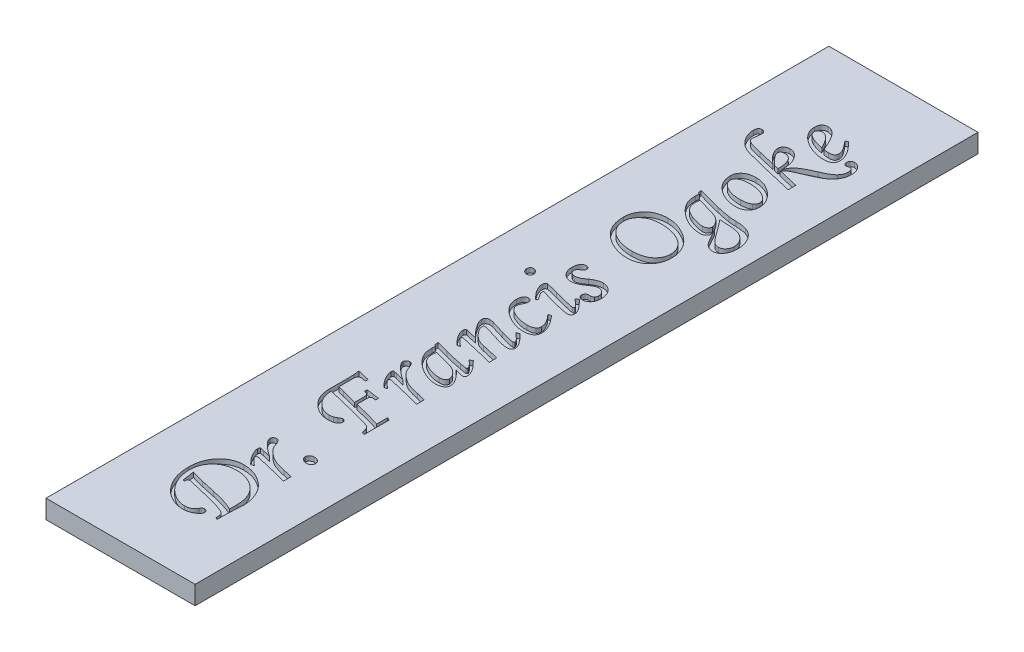
from build123d import *

# Parameters (mm, degrees)
BOSS_EXTRUDE1_DEPTH      = 66.675
BOSS_EXTRUDE1_DEPTH_BACK = 66.675
SKETCH3_W                = 25.4
SKETCH3_H                = 3.175
CUT_EXTRUDE1_DEPTH       = 0.79375


with BuildPart() as part:
    # Sketch3 → Boss-Extrude1 (new, two sides: drawn at the far end of the back side and taken through both)
    with BuildSketch(Plane.XY.offset(-BOSS_EXTRUDE1_DEPTH_BACK)):
        Rectangle(SKETCH3_W, SKETCH3_H)
    extrude(amount=BOSS_EXTRUDE1_DEPTH + BOSS_EXTRUDE1_DEPTH_BACK)

    # Sketch4 → Cut-Extrude1 (cut)
    # profile 1 of 16: a face of its own
    with BuildSketch(Plane(origin=(0, 1.5875, 0), x_dir=(1, 0, 0), z_dir=(0, 1, 0))):
        with BuildLine():
            Line((-3.408527516, -52.369856222), (-3.725830441, -52.283093704))
            add(Edge.make_bspline(
                [(-3.725830441, -52.283093704), (-3.737850592, -52.13258402), (-3.763000795, -51.817667083), (-3.827011478, -51.327551913), (-3.911149001, -50.798457124), (-3.981705302, -50.434441531), (-4.018344075, -50.245413981)],
                knots=[0, 0, 0, 0, 0.879460652, 1.84012782, 2.878412481, 4, 4, 4, 4], degree=3))
            add(Edge.make_bspline(
                [(-4.018344075, -50.245413981), (-3.852567386, -50.301728217), (-3.512771298, -50.417156733), (-2.983413328, -50.576455409), (-2.421475709, -50.721573676), (-2.03462658, -50.808380046), (-1.836886465, -50.852751611)],
                knots=[0, 0, 0, 0, 0.9271626, 1.900425364, 2.926790578, 4, 4, 4, 4], degree=3))
            Line((-1.836886465, -50.852751611), (0.577590481, -51.38076351))
            add(Edge.make_bspline(
                [(0.577590481, -51.38076351), (0.788536521, -51.427686345), (1.199033587, -51.518997307), (1.792102448, -51.668364063), (2.346957761, -51.817622646), (2.859476633, -51.977502591), (3.333976279, -52.137244024), (3.767604051, -52.302711868), (4.161898292, -52.473001479), (4.406460781, -52.597536145), (4.524045612, -52.657411998)],
                knots=[0, 0, 0, 0, 1.246806401, 2.42626203, 3.528511125, 4.561511712, 5.523423198, 6.416823405, 7.238813961, 8, 8, 8, 8], degree=3))
            add(Edge.make_bspline(
                [(4.524045612, -52.657411998), (4.524045612, -52.538423401), (4.524045612, -52.307056685), (4.524045612, -51.970748637), (4.524045612, -51.655924641), (4.524045612, -51.453478764), (4.524045612, -51.355974219)],
                knots=[0, 0, 0, 0, 1.097142857, 2.133333333, 3.100952381, 4, 4, 4, 4], degree=3))
            add(Edge.make_bspline(
                [(4.524045612, -51.355974219), (4.522291504, -51.232783355), (4.518848614, -50.99098951), (4.487231277, -50.634455006), (4.44136888, -50.289933111), (4.375193579, -49.956562029), (4.284886475, -49.636699507), (4.177549251, -49.328211148), (4.055800786, -49.029801109), (3.907414037, -48.747242285), (3.743873397, -48.476259136), (3.56312188, -48.218139969), (3.364145754, -47.97469066), (3.147852002, -47.745201773), (2.911737357, -47.532242283), (2.657510154, -47.33376099), (2.387420669, -47.147308371), (2.100574847, -46.977291152), (1.801144808, -46.823546334), (1.492341348, -46.689935002), (1.175713565, -46.578197503), (0.852102165, -46.485819634), (0.519954027, -46.414464986), (0.180693286, -46.361978543), (-0.166362662, -46.331883014), (-0.399876841, -46.32812806), (-0.518096182, -46.32622707)],
                knots=[0, 0, 0, 0, 1.108876087, 2.176455327, 3.220153502, 4.237073672, 5.233431218, 6.20981358, 7.176940925, 8.131888172, 9.079855142, 10.025132673, 10.966273431, 11.908266498, 12.861589586, 13.825966148, 14.810280397, 15.814384495, 16.825847582, 17.838841615, 18.841207958, 19.846744131, 20.866707514, 21.897815126, 22.93574381, 24, 24, 24, 24], degree=3))
            add(Edge.make_bspline(
                [(-0.518096182, -46.32622707), (-0.67114676, -46.329257804), (-0.969909313, -46.335173952), (-1.406481222, -46.390199625), (-1.821001828, -46.470512743), (-2.210609366, -46.595632975), (-2.579874473, -46.746717151), (-2.922877879, -46.940589971), (-3.245344871, -47.164132369), (-3.54122126, -47.421687856), (-3.809414774, -47.705360388), (-4.040604685, -48.014932954), (-4.23744301, -48.343853161), (-4.401048965, -48.693626315), (-4.523555491, -49.066978961), (-4.612408779, -49.460386568), (-4.669068889, -49.874409823), (-4.674806188, -50.157637437), (-4.677739217, -50.302429351)],
                knots=[0, 0, 0, 0, 1.133342806, 2.212343105, 3.255656027, 4.256658692, 5.238973399, 6.206391602, 7.169305645, 8.141419189, 9.107209001, 10.056087474, 10.997829931, 11.942750604, 12.910691636, 13.902724951, 14.927828886, 16, 16, 16, 16], degree=3))
            add(Edge.make_bspline(
                [(-4.677739217, -50.302429351), (-4.674886497, -50.426423602), (-4.669209826, -50.673161729), (-4.638083085, -51.040345218), (-4.578467951, -51.401422971), (-4.504462768, -51.758493808), (-4.399435249, -52.108964802), (-4.280777617, -52.456673723), (-4.131702221, -52.796025143), (-3.967967521, -53.130032117), (-3.781245751, -53.450832985), (-3.582011131, -53.758324105), (-3.365322185, -54.046949463), (-3.133629469, -54.317051914), (-2.89107149, -54.573502588), (-2.633457153, -54.812171893), (-2.35850353, -55.030289246), (-2.073887366, -55.232892984), (-1.781160346, -55.41125909), (-1.489336729, -55.569079569), (-1.199345173, -55.704034285), (-0.909891874, -55.812496892), (-0.623499224, -55.898332), (-0.338947361, -55.957228617), (-0.056471082, -55.996793243), (0.132080508, -56.001588391), (0.225582548, -56.003966287)],
                knots=[0, 0, 0, 0, 1.081103213, 2.151304428, 3.208849041, 4.269895994, 5.327636848, 6.396091191, 7.470574728, 8.556204061, 9.637307273, 10.704206439, 11.748692769, 12.780810486, 13.804928832, 14.824451564, 15.839178917, 16.862460927, 17.868096616, 18.825302841, 19.753529844, 20.653949094, 21.51778112, 22.356964132, 23.185224557, 24, 24, 24, 24], degree=3))
            add(Edge.make_bspline(
                [(0.225582548, -56.003966287), (0.313291814, -56.000784301), (0.483848541, -55.994596709), (0.731848054, -55.955997533), (0.960885993, -55.884887433), (1.174699338, -55.792178105), (1.366328781, -55.666074413), (1.540483057, -55.5143577), (1.697321785, -55.336344196), (1.783302472, -55.200418054), (1.826970749, -55.131383242)],
                knots=[0, 0, 0, 0, 1.098234064, 2.135592027, 3.130352065, 4.093468783, 5.043160056, 5.989012807, 6.978650325, 8, 8, 8, 8], degree=3))
            add(Edge.make_bspline(
                [(1.826970749, -55.131383242), (1.851737867, -55.092736443), (1.897773099, -55.020902716), (1.972921894, -54.931490502), (2.036388274, -54.857770922), (2.120912859, -54.794271773), (2.238680046, -54.741726326), (2.339448541, -54.737149171), (2.392166584, -54.734754586)],
                knots=[0, 0, 0, 0, 1.132523627, 2.10504862, 2.885165995, 3.526260391, 4.70583846, 6, 6, 6, 6], degree=3))
            add(Edge.make_bspline(
                [(2.392166584, -54.734754586), (2.427050837, -54.736763906), (2.495439811, -54.740703086), (2.595113576, -54.769079245), (2.68822533, -54.81752289), (2.77293391, -54.883085883), (2.844268814, -54.961294128), (2.897436056, -55.046804743), (2.932832918, -55.138635063), (2.935952492, -55.202953392), (2.937530987, -55.235498265)],
                knots=[0, 0, 0, 0, 1.025470684, 2.010388118, 3.021353536, 4.095777109, 5.145446822, 6.116774371, 7.047093735, 8, 8, 8, 8], degree=3))
            add(Edge.make_bspline(
                [(2.937530987, -55.235498265), (2.929810836, -55.308742173), (2.913602905, -55.462512764), (2.788462926, -55.680421117), (2.59867269, -55.892875021), (2.434600287, -56.014463152), (2.345066931, -56.080813089)],
                knots=[0, 0, 0, 0, 0.817900186, 1.717125675, 2.754248756, 4, 4, 4, 4], degree=3))
            add(Edge.make_bspline(
                [(2.345066931, -56.080813089), (2.207510224, -56.165730545), (1.939582152, -56.331129752), (1.511392389, -56.508104551), (1.077285493, -56.618244184), (0.784790942, -56.631827733), (0.639563708, -56.638572137)],
                knots=[0, 0, 0, 0, 1.064484062, 2.073364277, 3.043401066, 4, 4, 4, 4], degree=3))
            add(Edge.make_bspline(
                [(0.639563708, -56.638572137), (0.517955065, -56.636675541), (0.275640518, -56.632896427), (-0.085285631, -56.587299776), (-0.443437561, -56.521557938), (-0.798884293, -56.426694535), (-1.150403836, -56.304499438), (-1.500130148, -56.158470193), (-1.843834405, -55.980496917), (-2.185113654, -55.78123719), (-2.516110901, -55.557692633), (-2.828760157, -55.307424056), (-3.126883061, -55.040182273), (-3.407974694, -54.751478087), (-3.671663482, -54.441695027), (-3.913549565, -54.107311775), (-4.143074168, -53.75513102), (-4.352287289, -53.382400329), (-4.540935034, -52.993623778), (-4.704289026, -52.591807051), (-4.84313475, -52.179502095), (-4.958312668, -51.757652334), (-5.043570711, -51.32404002), (-5.109267952, -50.880854462), (-5.146567912, -50.425369501), (-5.151299479, -50.118227071), (-5.153693604, -49.962816063)],
                knots=[0, 0, 0, 0, 0.892528231, 1.77843094, 2.667466219, 3.565321182, 4.47685171, 5.398745436, 6.345876364, 7.316869007, 8.299771953, 9.2758895, 10.255546583, 11.238224728, 12.232747284, 13.240126893, 14.266839875, 15.318322956, 16.376769289, 17.438255268, 18.501335748, 19.5700127, 20.64701274, 21.744603105, 22.858791653, 24, 24, 24, 24], degree=3))
            add(Edge.make_bspline(
                [(-5.153693604, -49.962816063), (-5.14977349, -49.774287257), (-5.142120885, -49.406252986), (-5.085781584, -48.868611905), (-4.986129604, -48.361361733), (-4.849873958, -47.883495978), (-4.677555954, -47.433466972), (-4.458934254, -47.015804828), (-4.207349884, -46.623866059), (-3.913199846, -46.268437236), (-3.593766724, -45.946757604), (-3.248487499, -45.667738769), (-2.886296789, -45.427425399), (-2.501930483, -45.23289128), (-2.096653086, -45.083215651), (-1.671801336, -44.977740882), (-1.227511505, -44.911063505), (-0.924878971, -44.902645612), (-0.770946951, -44.898363907)],
                knots=[0, 0, 0, 0, 1.203585055, 2.349564275, 3.446287516, 4.499949565, 5.518843974, 6.516943418, 7.504671405, 8.486846783, 9.456760527, 10.394399883, 11.316233178, 12.226949029, 13.138336972, 14.068555797, 15.017583784, 16, 16, 16, 16], degree=3))
            add(Edge.make_bspline(
                [(-0.770946951, -44.898363907), (-0.626223132, -44.901154513), (-0.339385663, -44.906685397), (0.085589133, -44.952947107), (0.502675673, -45.026655947), (0.90973836, -45.134152456), (1.309963128, -45.267589274), (1.698178573, -45.43527226), (2.08040968, -45.628472512), (2.44779816, -45.853783503), (2.799862341, -46.096697154), (3.128112562, -46.354627527), (3.4290476, -46.625958427), (3.704926756, -46.908300034), (3.954840911, -47.204031682), (4.174145149, -47.515019218), (4.372460873, -47.834876727), (4.59273138, -48.275706341), (4.8187842, -48.835832483), (5.012051561, -49.517415376), (5.13497266, -50.198845879), (5.150792514, -50.653939515), (5.158651463, -50.880019831)],
                knots=[0, 0, 0, 0, 0.926951201, 1.837184367, 2.735392543, 3.638035727, 4.531975, 5.435611123, 6.344735262, 7.273498627, 8.194216139, 9.083818774, 9.945937045, 10.78824293, 11.611093864, 12.42340477, 13.224180136, 14.019653575, 15.577753707, 17.085869658, 18.552325372, 20, 20, 20, 20], degree=3))
            add(Edge.make_bspline(
                [(5.158651463, -50.880019831), (5.157729345, -50.919680054), (5.155731486, -51.005607873), (5.1546833, -51.144522716), (5.145834087, -51.303118998), (5.13620562, -51.482437775), (5.123620848, -51.681571844), (5.109434914, -51.901491217), (5.088160035, -52.140056912), (5.075802571, -52.306213339), (5.069410015, -52.392166584)],
                knots=[0, 0, 0, 0, 0.628413, 1.361519305, 2.200141354, 3.144009582, 4.206244464, 5.360759236, 6.634712408, 8, 8, 8, 8], degree=3))
            add(Edge.make_bspline(
                [(5.069410015, -52.392166584), (5.049170124, -52.687044367), (5.009796502, -53.260684151), (5.003203762, -53.835627054), (5, -54.11502231)],
                knots=[0, 0, 0, 0, 1.028093904, 2, 2, 2, 2], degree=3))
            add(Edge.make_bspline(
                [(5, -54.11502231), (5, -54.186084945), (5, -54.344736407), (5, -54.607502892), (5, -54.919847959), (5, -55.144604198), (5, -55.265245414)],
                knots=[0, 0, 0, 0, 0.74137931, 1.655172414, 2.74137931, 4, 4, 4, 4], degree=3))
            Line((5, -55.265245414), (4.682697075, -55.084283589))
            add(Edge.make_bspline(
                [(4.682697075, -55.084283589), (4.675446442, -54.96770976), (4.6624123, -54.758150165), (4.63204999, -54.480516956), (4.594788937, -54.275470561), (4.550681406, -54.129939121), (4.487648725, -54.027670095), (4.416375945, -53.940259651), (4.324321365, -53.862795685), (4.255208826, -53.818407642), (4.219137333, -53.795240456)],
                knots=[0, 0, 0, 0, 1.944688049, 3.495879345, 4.645273665, 5.415328289, 6.0075428, 6.632868811, 7.286461394, 8, 8, 8, 8], degree=3))
            add(Edge.make_bspline(
                [(4.219137333, -53.795240456), (4.181438106, -53.773165253), (4.097144421, -53.723806146), (3.95084284, -53.657211547), (3.77680793, -53.581967089), (3.572629733, -53.503880024), (3.340144159, -53.416435096), (3.077750347, -53.325857333), (2.78638996, -53.228093028), (2.581525555, -53.164351772), (2.473971244, -53.130887457)],
                knots=[0, 0, 0, 0, 0.560225601, 1.252637882, 2.060094579, 2.993348988, 4.056820397, 5.24717586, 6.554760623, 8, 8, 8, 8], degree=3))
            Line((2.473971244, -53.130887457), (0.146256817, -52.54090233))
            Line((0.146256817, -52.54090233), (-2.759048091, -51.854238969))
            add(Edge.make_bspline(
                [(-2.759048091, -51.854238969), (-2.824845168, -51.838768513), (-2.944827448, -51.810557829), (-3.067879242, -51.804787429), (-3.123450669, -51.802181458)],
                knots=[0, 0, 0, 0, 1.096779889, 2, 2, 2, 2], degree=3))
            add(Edge.make_bspline(
                [(-3.123450669, -51.802181458), (-3.167468144, -51.805939807), (-3.251277883, -51.813095743), (-3.358274302, -51.882796695), (-3.426136176, -51.994598225), (-3.430796311, -52.082082873), (-3.433316807, -52.129400099)],
                knots=[0, 0, 0, 0, 1.029367958, 1.959927517, 2.89659986, 4, 4, 4, 4], degree=3))
            add(Edge.make_bspline(
                [(-3.433316807, -52.129400099), (-3.431009043, -52.159164197), (-3.424778833, -52.239517533), (-3.414806159, -52.319500293), (-3.408527516, -52.369856222)],
                knots=[0, 0, 0, 0, 0.740830417, 2, 2, 2, 2], degree=3))
        make_face()
    # profile 2 of 16: a face of its own
    with BuildSketch(Plane(origin=(0, 1.5875, 0), x_dir=(1, 0, 0), z_dir=(0, 1, 0))):
        with BuildLine():
            Line((5, -42.645017353), (5, -43.946455131))
            Line((5, -43.946455131), (2.749132375, -43.356470005))
            add(Edge.make_bspline(
                [(2.749132375, -43.356470005), (2.476621804, -43.286372095), (1.939749329, -43.148272356), (1.142714053, -42.95585836), (0.367317965, -42.773291686), (-0.144436977, -42.662453985), (-0.396628656, -42.607833416)],
                knots=[0, 0, 0, 0, 1.044120099, 2.057018701, 3.042503205, 4, 4, 4, 4], degree=3))
            add(Edge.make_bspline(
                [(-0.396628656, -42.607833416), (-0.451860919, -42.595533595), (-0.551268676, -42.573396214), (-0.684191352, -42.553553608), (-0.78209306, -42.535587926), (-0.836185817, -42.532296343), (-0.85770947, -42.530986614)],
                knots=[0, 0, 0, 0, 1.4507061, 2.611000006, 3.447313195, 4, 4, 4, 4], degree=3))
            add(Edge.make_bspline(
                [(-0.85770947, -42.530986614), (-0.882965949, -42.533039576), (-0.929877338, -42.53685275), (-0.992941333, -42.574811778), (-1.025226576, -42.644253304), (-1.027505527, -42.695973522), (-1.028755578, -42.724343084)],
                knots=[0, 0, 0, 0, 1.023146048, 1.900391694, 2.848323326, 4, 4, 4, 4], degree=3))
            add(Edge.make_bspline(
                [(-1.028755578, -42.724343084), (-1.025900082, -42.749495315), (-1.019136089, -42.809075004), (-0.97085575, -42.900477321), (-0.906284825, -43.012632514), (-0.829226914, -43.115026251), (-0.749073371, -43.212799901), (-0.663675813, -43.299611465), (-0.563963289, -43.405745626), (-0.436776616, -43.517197161), (-0.297784043, -43.650298382), (-0.13501972, -43.793148892), (0.044873624, -43.952201939), (0.173300729, -44.060743914), (0.240456123, -44.117501239)],
                knots=[0, 0, 0, 0, 0.473246814, 1.121009778, 1.916259303, 2.918417322, 3.526064876, 4.296572721, 5.209868489, 6.267050422, 7.4781545, 8.833684422, 10.344312357, 12, 12, 12, 12], degree=3))
            Line((0.240456123, -44.117501239), (-0.235498265, -44.276152702))
            add(Edge.make_bspline(
                [(-0.235498265, -44.276152702), (-0.374013032, -44.139376246), (-0.642303469, -43.874452759), (-0.996377951, -43.456341771), (-1.301202587, -43.041837056), (-1.541866417, -42.629462844), (-1.730539618, -42.243501749), (-1.868611279, -41.901267712), (-1.960100433, -41.606866796), (-1.974297976, -41.423379093), (-1.980664353, -41.341100645)],
                knots=[0, 0, 0, 0, 1.341953613, 2.599241416, 3.774513272, 4.885797771, 5.887458592, 6.73406582, 7.432337434, 8, 8, 8, 8], degree=3))
            add(Edge.make_bspline(
                [(-1.980664353, -41.341100645), (-1.978954767, -41.293513285), (-1.9758845, -41.208050576), (-1.939867575, -41.098329845), (-1.881926358, -41.017946815), (-1.826688974, -41.006545743), (-1.802181458, -41.001487357)],
                knots=[0, 0, 0, 0, 1.353899392, 2.431484129, 3.304086744, 4, 4, 4, 4], degree=3))
            add(Edge.make_bspline(
                [(-1.802181458, -41.001487357), (-1.777353429, -41.003659899), (-1.713264523, -41.009267908), (-1.596651959, -41.030876888), (-1.437283458, -41.066251372), (-1.317064111, -41.096185926), (-1.249380268, -41.113039167)],
                knots=[0, 0, 0, 0, 0.529538259, 1.366903866, 2.517559208, 4, 4, 4, 4], degree=3))
            Line((-1.249380268, -41.113039167), (0.185919683, -41.479920674))
            add(Edge.make_bspline(
                [(0.185919683, -41.479920674), (-0.023585026, -41.341562629), (-0.435525148, -41.069515141), (-1.009207574, -40.61634181), (-1.540690468, -40.143016784), (-1.860052384, -39.80008251), (-2.01784829, -39.630639564)],
                knots=[0, 0, 0, 0, 1.043677459, 2.052138213, 3.037566479, 4, 4, 4, 4], degree=3))
            add(Edge.make_bspline(
                [(-2.01784829, -39.630639564), (-2.083332269, -39.552660859), (-2.204319047, -39.408589099), (-2.344669045, -39.19127954), (-2.436896974, -38.992235159), (-2.450439534, -38.86206936), (-2.456618741, -38.802677243)],
                knots=[0, 0, 0, 0, 1.279146713, 2.363323658, 3.253216489, 4, 4, 4, 4], degree=3))
            add(Edge.make_bspline(
                [(-2.456618741, -38.802677243), (-2.453883207, -38.763677768), (-2.448547746, -38.687612117), (-2.417032997, -38.577651094), (-2.355999432, -38.482127526), (-2.280416198, -38.394903361), (-2.187195464, -38.325645761), (-2.086235253, -38.27036578), (-1.975685467, -38.240884032), (-1.89983507, -38.236971048), (-1.861675756, -38.235002479)],
                knots=[0, 0, 0, 0, 1.02716901, 2.003418691, 2.968722159, 3.984796309, 5.023623781, 6.005421064, 6.99655419, 8, 8, 8, 8], degree=3))
            add(Edge.make_bspline(
                [(-1.861675756, -38.235002479), (-1.821869499, -38.236932284), (-1.743574198, -38.240728035), (-1.630400641, -38.269909819), (-1.529097993, -38.325055949), (-1.42974173, -38.401124148), (-1.334766273, -38.522653844), (-1.237717657, -38.697202177), (-1.132199974, -38.931559081), (-1.065565718, -39.110416873), (-1.028755578, -39.209221616)],
                knots=[0, 0, 0, 0, 0.693177916, 1.363418161, 2.013581126, 2.690126397, 3.528536773, 4.676329381, 6.163935612, 8, 8, 8, 8], degree=3))
            add(Edge.make_bspline(
                [(-1.028755578, -39.209221616), (-0.992147421, -39.308120701), (-0.921649995, -39.498573639), (-0.797260717, -39.764601302), (-0.66338313, -40.002474843), (-0.512948419, -40.218895359), (-0.331526013, -40.421272407), (-0.120645105, -40.631240408), (0.135324987, -40.844918157), (0.41635967, -41.065264292), (0.706643548, -41.270938559), (0.981437412, -41.450624497), (1.23170012, -41.595670462), (1.433299647, -41.694515901), (1.604863375, -41.763276113), (1.765135114, -41.815943892), (1.960313587, -41.875802129), (2.190286229, -41.94191886), (2.455895435, -42.017203785), (2.757035257, -42.095289144), (3.093482934, -42.179861836), (3.329172568, -42.237763261), (3.45314824, -42.268220129)],
                knots=[0, 0, 0, 0, 1.110708496, 2.138924714, 3.090259246, 3.983917359, 4.909365599, 5.949746143, 7.116886804, 8.419515261, 9.711892046, 10.863736856, 11.877701499, 12.757685161, 13.226511401, 13.823927962, 14.534404968, 15.377483492, 16.344934113, 17.442980541, 18.654976029, 20, 20, 20, 20], degree=3))
            Line((3.45314824, -42.268220129), (5, -42.645017353))
        make_face()
    # profile 3 of 16: a face of its own
    with BuildSketch(Plane(origin=(0, 1.5875, 0), x_dir=(1, 0, 0), z_dir=(0, 1, 0))):
        with BuildLine():
            add(Edge.make_bspline(
                [(3.254833912, -38.485374318), (3.257621138, -38.435451994), (3.263025186, -38.338659463), (3.307683108, -38.19980577), (3.380155069, -38.073701872), (3.483912564, -37.965421088), (3.606712714, -37.873848846), (3.747767046, -37.805805391), (3.90452123, -37.764973488), (4.013962432, -37.761064149), (4.070401587, -37.759048091)],
                knots=[0, 0, 0, 0, 0.98159276, 1.903173577, 2.844104295, 3.823129028, 4.835684381, 5.847716179, 6.890060819, 8, 8, 8, 8], degree=3))
            add(Edge.make_bspline(
                [(4.070401587, -37.759048091), (4.150830493, -37.761333725), (4.304147742, -37.765690704), (4.520286408, -37.813848006), (4.710166176, -37.89020297), (4.869846914, -37.99742775), (4.998426406, -38.127299484), (5.092250042, -38.275842654), (5.150185462, -38.44242655), (5.155780282, -38.55927272), (5.158651463, -38.61923649)],
                knots=[0, 0, 0, 0, 1.24009155, 2.36391907, 3.399451324, 4.383300886, 5.312685463, 6.201320917, 7.07694382, 8, 8, 8, 8], degree=3))
            add(Edge.make_bspline(
                [(5.158651463, -38.61923649), (5.156991741, -38.669213334), (5.153771406, -38.76618271), (5.107487951, -38.903634265), (5.040636139, -39.030092179), (4.945762364, -39.141352097), (4.830364042, -39.232640377), (4.697014964, -39.298786771), (4.548772793, -39.339737182), (4.444167504, -39.343579696), (4.390183441, -39.345562717)],
                knots=[0, 0, 0, 0, 1.010157701, 1.959994936, 2.913381871, 3.901564746, 4.905152474, 5.880576668, 6.906220855, 8, 8, 8, 8], degree=3))
            add(Edge.make_bspline(
                [(4.390183441, -39.345562717), (4.310399291, -39.342955167), (4.153618082, -39.337831156), (3.928962128, -39.2756518), (3.714939161, -39.189800842), (3.591982139, -39.098883709), (3.529995042, -39.053049083)],
                knots=[0, 0, 0, 0, 1.030978626, 2.025942206, 3.004805837, 4, 4, 4, 4], degree=3))
            add(Edge.make_bspline(
                [(3.529995042, -39.053049083), (3.487337518, -39.016159228), (3.405119037, -38.945057404), (3.318447451, -38.806513233), (3.263752641, -38.652196451), (3.257863637, -38.542044417), (3.254833912, -38.485374318)],
                knots=[0, 0, 0, 0, 1.029763566, 1.984775184, 2.963223966, 4, 4, 4, 4], degree=3))
        make_face()
    # profile 4 of 16: a face of its own
    with BuildSketch(Plane(origin=(0, 1.5875, 0), x_dir=(1, 0, 0), z_dir=(0, 1, 0))):
        with BuildLine():
            Line((-2.773921666, -21.735250372), (-2.773921666, -22.21120476))
            add(Edge.make_bspline(
                [(-2.773921666, -22.21120476), (-2.878787486, -22.190147508), (-3.068365197, -22.15207995), (-3.321835704, -22.106597375), (-3.514630398, -22.079863405), (-3.622501652, -22.072782992), (-3.666336143, -22.069905801)],
                knots=[0, 0, 0, 0, 1.419285159, 2.565801053, 3.417199881, 4, 4, 4, 4], degree=3))
            add(Edge.make_bspline(
                [(-3.666336143, -22.069905801), (-3.708743578, -22.072186955), (-3.789361998, -22.07652353), (-3.902965428, -22.112178254), (-3.999015668, -22.172381898), (-4.078620298, -22.259689939), (-4.13573463, -22.381731173), (-4.175818682, -22.540296782), (-4.198962658, -22.73938106), (-4.2007909, -22.885410092), (-4.201784829, -22.964799207)],
                knots=[0, 0, 0, 0, 0.853518507, 1.622576663, 2.371161914, 3.113980863, 3.970581553, 5.057428551, 6.400262339, 8, 8, 8, 8], degree=3))
            Line((-4.201784829, -22.964799207), (-4.194348042, -23.482895389))
            Line((-4.194348042, -23.482895389), (-4.201784829, -23.651462568))
            Line((-4.201784829, -23.651462568), (-4.201784829, -25.270203272))
            add(Edge.make_bspline(
                [(-4.201784829, -25.270203272), (-4.181971736, -25.275233491), (-4.134963508, -25.287168108), (-4.054201511, -25.305452364), (-3.955249987, -25.335036415), (-3.835287079, -25.362695639), (-3.697764732, -25.400878749), (-3.540048078, -25.443413503), (-3.363010323, -25.489738156), (-3.238293396, -25.523000447), (-3.173029251, -25.540406544)],
                knots=[0, 0, 0, 0, 0.461227125, 1.094300113, 1.867745342, 2.790199592, 3.8710694, 5.087653001, 6.475974039, 8, 8, 8, 8], degree=3))
            add(Edge.make_bspline(
                [(-3.173029251, -25.540406544), (-3.042575507, -25.577959651), (-2.788640722, -25.651058664), (-2.415288838, -25.751898073), (-2.060765971, -25.848422735), (-1.725221633, -25.941382028), (-1.406331477, -26.02196744), (-1.10682998, -26.099750473), (-0.824229226, -26.169248124), (-0.641262806, -26.211567135), (-0.55280119, -26.232027764)],
                knots=[0, 0, 0, 0, 1.202092804, 2.339934198, 3.424509297, 4.455818481, 5.42304532, 6.337021206, 7.195973827, 8, 8, 8, 8], degree=3))
            Line((-0.55280119, -26.232027764), (-0.55280119, -24.757064948))
            add(Edge.make_bspline(
                [(-0.55280119, -24.757064948), (-0.553539685, -24.675098156), (-0.554871915, -24.527231835), (-0.579690276, -24.329104052), (-0.614867171, -24.173839887), (-0.663474328, -24.096091247), (-0.684184432, -24.062964799)],
                knots=[0, 0, 0, 0, 1.370818841, 2.472927559, 3.349358594, 4, 4, 4, 4], degree=3))
            add(Edge.make_bspline(
                [(-0.684184432, -24.062964799), (-0.712775747, -24.03568582), (-0.779586339, -23.971941822), (-0.927859907, -23.908831135), (-1.119442114, -23.847279759), (-1.265472016, -23.815343426), (-1.346058503, -23.797719385)],
                knots=[0, 0, 0, 0, 0.651551511, 1.522509262, 2.632798667, 4, 4, 4, 4], degree=3))
            Line((-1.346058503, -23.797719385), (-1.346058503, -23.321764998))
            add(Edge.make_bspline(
                [(-1.346058503, -23.321764998), (-0.98360365, -23.380016658), (-0.245079221, -23.498708058), (0.497120748, -23.591709804), (0.875061973, -23.639067923)],
                knots=[0, 0, 0, 0, 0.981564965, 2, 2, 2, 2], degree=3))
            Line((0.875061973, -23.639067923), (0.875061973, -24.11502231))
            add(Edge.make_bspline(
                [(0.875061973, -24.11502231), (0.803214281, -24.106326723), (0.675282285, -24.090843359), (0.508061012, -24.076027371), (0.390299634, -24.059835886), (0.328068601, -24.058502998), (0.30490828, -24.058006941)],
                knots=[0, 0, 0, 0, 1.515000998, 2.697610708, 3.515294019, 4, 4, 4, 4], degree=3))
            add(Edge.make_bspline(
                [(0.30490828, -24.058006941), (0.273202772, -24.060498123), (0.211080559, -24.065379221), (0.123702227, -24.10082722), (0.050684798, -24.164088544), (0.017487168, -24.219628357), (0, -24.248884482)],
                knots=[0, 0, 0, 0, 1.001869807, 1.963014421, 2.926998464, 4, 4, 4, 4], degree=3))
            add(Edge.make_bspline(
                [(0, -24.248884482), (-0.009876671, -24.275109426), (-0.034869352, -24.341471028), (-0.052836663, -24.469870534), (-0.066325181, -24.64360683), (-0.07307312, -24.775196061), (-0.076846802, -24.848785325)],
                knots=[0, 0, 0, 0, 0.552403063, 1.397842927, 2.544783484, 4, 4, 4, 4], degree=3))
            Line((-0.076846802, -24.848785325), (-0.076846802, -26.358453148))
            add(Edge.make_bspline(
                [(-0.076846802, -26.358453148), (0.121641646, -26.398114693), (0.526939301, -26.47910042), (1.144107466, -26.618937045), (1.783723762, -26.775251295), (2.326072081, -26.917250259), (2.758003128, -27.036806187), (3.067518698, -27.118136322), (3.356139655, -27.205727288), (3.627463964, -27.282104565), (3.878525331, -27.361315804), (4.11201781, -27.430804433), (4.32429898, -27.503920277), (4.459601879, -27.55079997), (4.524045612, -27.573128409)],
                knots=[0, 0, 0, 0, 1.530227997, 3.124604096, 4.783706059, 6.508046587, 7.362778307, 8.172034102, 8.927181501, 9.642846882, 10.30285292, 10.917388835, 11.484360601, 12, 12, 12, 12], degree=3))
            add(Edge.make_bspline(
                [(4.524045612, -27.573128409), (4.524045612, -27.365724674), (4.524045612, -26.974053875), (4.524045612, -26.582383077), (4.524045612, -26.398116014)],
                knots=[0, 0, 0, 0, 1.05907173, 2, 2, 2, 2], degree=3))
            add(Edge.make_bspline(
                [(4.524045612, -26.398116014), (4.524045612, -26.286564204), (4.524045612, -26.065113204), (4.524045612, -25.843662205), (4.524045612, -25.733763014)],
                knots=[0, 0, 0, 0, 1.007462687, 2, 2, 2, 2], degree=3))
            Line((4.524045612, -25.733763014), (5, -25.892414477))
            add(Edge.make_bspline(
                [(5, -25.892414477), (5, -25.970087589), (5, -26.119649645), (5, -26.269211701), (5, -26.341100645)],
                knots=[0, 0, 0, 0, 1.038674033, 2, 2, 2, 2], degree=3))
            add(Edge.make_bspline(
                [(5, -26.341100645), (5, -26.360105768), (5, -26.407205421), (5, -26.489836391), (5, -26.597256652), (5, -26.728639894), (5, -26.884812428), (5, -27.064947942), (5, -27.269872748), (5, -27.414476946), (5, -27.491323748)],
                knots=[0, 0, 0, 0, 0.396551724, 0.982758621, 1.724137931, 2.637931034, 3.724137931, 4.982758621, 6.396551724, 8, 8, 8, 8], degree=3))
            add(Edge.make_bspline(
                [(5, -27.491323748), (5, -27.583870435), (5, -27.760700711), (5, -28.015204098), (5, -28.247397124), (5, -28.395306561), (5, -28.465542885)],
                knots=[0, 0, 0, 0, 1.139949109, 2.178117048, 3.134860051, 4, 4, 4, 4], degree=3))
            add(Edge.make_bspline(
                [(5, -28.465542885), (5, -28.744009255), (5, -29.318294497), (5, -29.892579739), (5, -30.188398612)],
                knots=[0, 0, 0, 0, 0.969784173, 2, 2, 2, 2], degree=3))
            Line((5, -30.188398612), (4.524045612, -30.074367873))
            add(Edge.make_bspline(
                [(4.524045612, -30.074367873), (4.504280533, -29.96016078), (4.468342706, -29.752503896), (4.407770162, -29.474049192), (4.346224645, -29.257934113), (4.260174224, -29.060172278), (4.134160987, -28.876629759), (4.00525128, -28.774416031), (3.943976202, -28.725830441)],
                knots=[0, 0, 0, 0, 1.379790679, 2.508802439, 3.392721793, 4.049021292, 5.072634825, 6, 6, 6, 6], degree=3))
            add(Edge.make_bspline(
                [(3.943976202, -28.725830441), (3.890515026, -28.702081382), (3.76393442, -28.645850477), (3.535684129, -28.565678323), (3.240955779, -28.474157902), (2.881452221, -28.359606413), (2.452620786, -28.24191402), (1.959230244, -28.103714014), (1.39838482, -27.956320133), (1.002333176, -27.85316605), (0.793257313, -27.798710957)],
                knots=[0, 0, 0, 0, 0.427033685, 1.011092273, 1.764826965, 2.680883092, 3.765782496, 5.011512455, 6.422375916, 8, 8, 8, 8], degree=3))
            Line((0.793257313, -27.798710957), (-4.201784829, -26.576598909))
            add(Edge.make_bspline(
                [(-4.201784829, -26.576598909), (-4.191976597, -26.754721278), (-4.172856861, -27.101945206), (-4.073705077, -27.604600644), (-3.923709961, -28.073071297), (-3.718369088, -28.504466653), (-3.468854118, -28.897791882), (-3.172469581, -29.246586614), (-2.841251483, -29.557386159), (-2.473883974, -29.820334213), (-2.086145933, -30.031590802), (-1.690777808, -30.188881853), (-1.291179943, -30.285169569), (-1.02264345, -30.296720836), (-0.889935548, -30.302429351)],
                knots=[0, 0, 0, 0, 1.165944869, 2.272841762, 3.34135544, 4.376356834, 5.390131612, 6.379969533, 7.363007824, 8.354704153, 9.327205985, 10.244783422, 11.132590479, 12, 12, 12, 12], degree=3))
            add(Edge.make_bspline(
                [(-0.889935548, -30.302429351), (-0.780371052, -30.297634679), (-0.557504442, -30.287881772), (-0.340740178, -30.235075817), (-0.230540407, -30.208230045)],
                knots=[0, 0, 0, 0, 0.983229346, 2, 2, 2, 2], degree=3))
            add(Edge.make_bspline(
                [(-0.230540407, -30.208230045), (-0.195626915, -30.197233929), (-0.116911534, -30.17244227), (0.009061608, -30.1165441), (0.155370292, -30.03912069), (0.257345608, -29.976667949), (0.312345067, -29.942984631)],
                knots=[0, 0, 0, 0, 0.72429915, 1.632992865, 2.723376229, 4, 4, 4, 4], degree=3))
            add(Edge.make_bspline(
                [(0.312345067, -29.942984631), (0.378453714, -29.900903236), (0.498278723, -29.824628744), (0.669407262, -29.743590935), (0.804226625, -29.682336862), (0.887069705, -29.672141996), (0.922161626, -29.6678235)],
                knots=[0, 0, 0, 0, 1.39161727, 2.522371249, 3.374083728, 4, 4, 4, 4], degree=3))
            add(Edge.make_bspline(
                [(0.922161626, -29.6678235), (0.950487577, -29.669811705), (1.006030156, -29.67371025), (1.086210919, -29.702659813), (1.159465671, -29.751569578), (1.22511569, -29.818692629), (1.282428088, -29.899104086), (1.322083643, -29.993964678), (1.348004085, -30.09941892), (1.349983604, -30.174182262), (1.351016361, -30.213187903)],
                knots=[0, 0, 0, 0, 0.881232648, 1.727953788, 2.620393744, 3.603285143, 4.638703907, 5.676360035, 6.787707151, 8, 8, 8, 8], degree=3))
            add(Edge.make_bspline(
                [(1.351016361, -30.213187903), (1.34670915, -30.270842978), (1.338321297, -30.383120357), (1.271206884, -30.543303261), (1.159922237, -30.683766893), (1.060514531, -30.755848542), (1.008924145, -30.793257313)],
                knots=[0, 0, 0, 0, 0.981569525, 1.91150654, 2.916118389, 4, 4, 4, 4], degree=3))
            add(Edge.make_bspline(
                [(1.008924145, -30.793257313), (0.926070051, -30.840272307), (0.751799627, -30.93916088), (0.444370292, -31.02848111), (0.093911103, -31.085527198), (-0.155896429, -31.092180229), (-0.287555776, -31.095686663)],
                knots=[0, 0, 0, 0, 0.84545447, 1.778279176, 2.829057269, 4, 4, 4, 4], degree=3))
            add(Edge.make_bspline(
                [(-0.287555776, -31.095686663), (-0.423366224, -31.092436972), (-0.693253234, -31.085979078), (-1.093107328, -31.016519709), (-1.485233923, -30.914857599), (-1.868094626, -30.765080087), (-2.243244496, -30.577130156), (-2.60791857, -30.343335746), (-2.968601427, -30.073411774), (-3.192283777, -29.864238573), (-3.306891423, -29.757064948)],
                knots=[0, 0, 0, 0, 0.960820797, 1.909374836, 2.866052605, 3.825625235, 4.814840406, 5.83273442, 6.889562776, 8, 8, 8, 8], degree=3))
            add(Edge.make_bspline(
                [(-3.306891423, -29.757064948), (-3.416992167, -29.647934197), (-3.634727358, -29.432117262), (-3.912386516, -29.06810359), (-4.150410705, -28.681671261), (-4.344434235, -28.268475534), (-4.493097073, -27.829093146), (-4.599407591, -27.364882665), (-4.665047578, -26.875115049), (-4.673450106, -26.539622581), (-4.677739217, -26.368368865)],
                knots=[0, 0, 0, 0, 0.98731301, 1.952509858, 2.910216336, 3.876433364, 4.856000187, 5.86169375, 6.908491461, 8, 8, 8, 8], degree=3))
            Line((-4.677739217, -26.368368865), (-4.677739217, -23.225086763))
            add(Edge.make_bspline(
                [(-4.677739217, -23.225086763), (-4.679300316, -23.04075384), (-4.682565069, -22.655255166), (-4.70871438, -22.270620621), (-4.722359941, -22.069905801)],
                knots=[0, 0, 0, 0, 0.956334925, 2, 2, 2, 2], degree=3))
            add(Edge.make_bspline(
                [(-4.722359941, -22.069905801), (-4.725316005, -22.029381743), (-4.732575308, -21.929865512), (-4.756616547, -21.754760074), (-4.791726833, -21.525104499), (-4.820430108, -21.354282335), (-4.836390679, -21.259295984)],
                knots=[0, 0, 0, 0, 0.595285049, 1.46186061, 2.588657386, 4, 4, 4, 4], degree=3))
            add(Edge.make_bspline(
                [(-4.836390679, -21.259295984), (-4.708342645, -21.290819161), (-4.463919832, -21.350991764), (-4.115107253, -21.434825833), (-3.80208129, -21.509823436), (-3.525906354, -21.573474901), (-3.286489982, -21.628976331), (-3.083948515, -21.673182315), (-2.917205651, -21.708832036), (-2.817751967, -21.727169053), (-2.773921666, -21.735250372)],
                knots=[0, 0, 0, 0, 1.495067862, 2.853840719, 4.067227245, 5.144363606, 6.067021765, 6.853502171, 7.494726153, 8, 8, 8, 8], degree=3))
        make_face()
    # profile 5 of 16: a face of its own
    with BuildSketch(Plane(origin=(0, 1.5875, 0), x_dir=(1, 0, 0), z_dir=(0, 1, 0))):
        with BuildLine():
            Line((5, -19.957858205), (5, -21.259295984))
            Line((5, -21.259295984), (2.749132375, -20.669310858))
            add(Edge.make_bspline(
                [(2.749132375, -20.669310858), (2.476621804, -20.599212947), (1.939749329, -20.461113209), (1.142714053, -20.268699213), (0.367317965, -20.086132539), (-0.144436977, -19.975294838), (-0.396628656, -19.920674269)],
                knots=[0, 0, 0, 0, 1.044120099, 2.057018701, 3.042503205, 4, 4, 4, 4], degree=3))
            add(Edge.make_bspline(
                [(-0.396628656, -19.920674269), (-0.451860919, -19.908374448), (-0.551268676, -19.886237067), (-0.684191352, -19.866394461), (-0.78209306, -19.848428779), (-0.836185817, -19.845137196), (-0.85770947, -19.843827467)],
                knots=[0, 0, 0, 0, 1.4507061, 2.611000006, 3.447313195, 4, 4, 4, 4], degree=3))
            add(Edge.make_bspline(
                [(-0.85770947, -19.843827467), (-0.882965949, -19.845880429), (-0.929877338, -19.849693602), (-0.992941333, -19.88765263), (-1.025226576, -19.957094157), (-1.027505527, -20.008814374), (-1.028755578, -20.037183937)],
                knots=[0, 0, 0, 0, 1.023146048, 1.900391694, 2.848323326, 4, 4, 4, 4], degree=3))
            add(Edge.make_bspline(
                [(-1.028755578, -20.037183937), (-1.025900082, -20.062336168), (-1.019136089, -20.121915857), (-0.97085575, -20.213318173), (-0.906284825, -20.325473367), (-0.829226914, -20.427867104), (-0.749073371, -20.525640753), (-0.663675813, -20.612452317), (-0.563963289, -20.718586479), (-0.436776616, -20.830038014), (-0.297784043, -20.963139235), (-0.13501972, -21.105989745), (0.044873624, -21.265042792), (0.173300729, -21.373584766), (0.240456123, -21.430342092)],
                knots=[0, 0, 0, 0, 0.473246814, 1.121009778, 1.916259303, 2.918417322, 3.526064876, 4.296572721, 5.209868489, 6.267050422, 7.4781545, 8.833684422, 10.344312357, 12, 12, 12, 12], degree=3))
            Line((0.240456123, -21.430342092), (-0.235498265, -21.588993555))
            add(Edge.make_bspline(
                [(-0.235498265, -21.588993555), (-0.374013032, -21.452217098), (-0.642303469, -21.187293612), (-0.996377951, -20.769182624), (-1.301202587, -20.354677909), (-1.541866417, -19.942303696), (-1.730539618, -19.556342602), (-1.868611279, -19.214108565), (-1.960100433, -18.919707649), (-1.974297976, -18.736219946), (-1.980664353, -18.653941497)],
                knots=[0, 0, 0, 0, 1.341953613, 2.599241416, 3.774513272, 4.885797771, 5.887458592, 6.73406582, 7.432337434, 8, 8, 8, 8], degree=3))
            add(Edge.make_bspline(
                [(-1.980664353, -18.653941497), (-1.978954767, -18.606354138), (-1.9758845, -18.520891429), (-1.939867575, -18.411170698), (-1.881926358, -18.330787667), (-1.826688974, -18.319386595), (-1.802181458, -18.31432821)],
                knots=[0, 0, 0, 0, 1.353899392, 2.431484129, 3.304086744, 4, 4, 4, 4], degree=3))
            add(Edge.make_bspline(
                [(-1.802181458, -18.31432821), (-1.777353429, -18.316500752), (-1.713264523, -18.32210876), (-1.596651959, -18.343717741), (-1.437283458, -18.379092224), (-1.317064111, -18.409026779), (-1.249380268, -18.42588002)],
                knots=[0, 0, 0, 0, 0.529538259, 1.366903866, 2.517559208, 4, 4, 4, 4], degree=3))
            Line((-1.249380268, -18.42588002), (0.185919683, -18.792761527))
            add(Edge.make_bspline(
                [(0.185919683, -18.792761527), (-0.023585026, -18.654403482), (-0.435525148, -18.382355994), (-1.009207574, -17.929182663), (-1.540690468, -17.455857637), (-1.860052384, -17.112923363), (-2.01784829, -16.943480416)],
                knots=[0, 0, 0, 0, 1.043677459, 2.052138213, 3.037566479, 4, 4, 4, 4], degree=3))
            add(Edge.make_bspline(
                [(-2.01784829, -16.943480416), (-2.083332269, -16.865501712), (-2.204319047, -16.721429952), (-2.344669045, -16.504120393), (-2.436896974, -16.305076011), (-2.450439534, -16.174910213), (-2.456618741, -16.115518096)],
                knots=[0, 0, 0, 0, 1.279146713, 2.363323658, 3.253216489, 4, 4, 4, 4], degree=3))
            add(Edge.make_bspline(
                [(-2.456618741, -16.115518096), (-2.453883207, -16.07651862), (-2.448547746, -16.00045297), (-2.417032997, -15.890491947), (-2.355999432, -15.794968379), (-2.280416198, -15.707744214), (-2.187195464, -15.638486613), (-2.086235253, -15.583206633), (-1.975685467, -15.553724885), (-1.89983507, -15.549811901), (-1.861675756, -15.547843332)],
                knots=[0, 0, 0, 0, 1.02716901, 2.003418691, 2.968722159, 3.984796309, 5.023623781, 6.005421064, 6.99655419, 8, 8, 8, 8], degree=3))
            add(Edge.make_bspline(
                [(-1.861675756, -15.547843332), (-1.821869499, -15.549773136), (-1.743574198, -15.553568888), (-1.630400641, -15.582750672), (-1.529097993, -15.637896801), (-1.42974173, -15.713965001), (-1.334766273, -15.835494696), (-1.237717657, -16.01004303), (-1.132199974, -16.244399933), (-1.065565718, -16.423257726), (-1.028755578, -16.522062469)],
                knots=[0, 0, 0, 0, 0.693177916, 1.363418161, 2.013581126, 2.690126397, 3.528536773, 4.676329381, 6.163935612, 8, 8, 8, 8], degree=3))
            add(Edge.make_bspline(
                [(-1.028755578, -16.522062469), (-0.992147421, -16.620961554), (-0.921649995, -16.811414492), (-0.797260717, -17.077442154), (-0.66338313, -17.315315696), (-0.512948419, -17.531736212), (-0.331526013, -17.73411326), (-0.120645105, -17.944081261), (0.135324987, -18.15775901), (0.41635967, -18.378105145), (0.706643548, -18.583779412), (0.981437412, -18.763465349), (1.23170012, -18.908511314), (1.433299647, -19.007356754), (1.604863375, -19.076116966), (1.765135114, -19.128784744), (1.960313587, -19.188642982), (2.190286229, -19.254759713), (2.455895435, -19.330044638), (2.757035257, -19.408129997), (3.093482934, -19.492702688), (3.329172568, -19.550604113), (3.45314824, -19.581060982)],
                knots=[0, 0, 0, 0, 1.110708496, 2.138924714, 3.090259246, 3.983917359, 4.909365599, 5.949746143, 7.116886804, 8.419515261, 9.711892046, 10.863736856, 11.877701499, 12.757685161, 13.226511401, 13.823927962, 14.534404968, 15.377483492, 16.344934113, 17.442980541, 18.654976029, 20, 20, 20, 20], degree=3))
            Line((3.45314824, -19.581060982), (5, -19.957858205))
        make_face()
    # profile 6 of 16: a face of its own
    with BuildSketch(Plane(origin=(0, 1.5875, 0), x_dir=(1, 0, 0), z_dir=(0, 1, 0))):
        with BuildLine():
            Line((-2.206246901, -10.894893406), (-2.283093704, -10.297471492))
            Line((-2.283093704, -10.297471492), (-0.171046108, -10.877540902))
            add(Edge.make_bspline(
                [(-0.171046108, -10.877540902), (0.046872586, -10.935441746), (0.498011026, -11.05530891), (1.200372725, -11.223115291), (1.951277439, -11.383769784), (2.46802553, -11.48485568), (2.7342588, -11.536936044)],
                knots=[0, 0, 0, 0, 0.90796384, 1.879679904, 2.90759199, 4, 4, 4, 4], degree=3))
            add(Edge.make_bspline(
                [(2.7342588, -11.536936044), (2.805308501, -11.550222785), (2.940723915, -11.57554632), (3.134826781, -11.610780488), (3.30933261, -11.639562919), (3.463475787, -11.666243163), (3.5978482, -11.681626156), (3.711454489, -11.698511488), (3.805879347, -11.705905937), (3.862164533, -11.707347205), (3.886960833, -11.707982152)],
                knots=[0, 0, 0, 0, 1.487344639, 2.834767631, 4.05909769, 5.126904251, 6.052745403, 6.841506106, 7.489628368, 8, 8, 8, 8], degree=3))
            add(Edge.make_bspline(
                [(3.886960833, -11.707982152), (3.910598327, -11.705829628), (3.955210576, -11.70176706), (4.013443822, -11.664372623), (4.04465547, -11.598809958), (4.046855527, -11.549665345), (4.048091225, -11.522062469)],
                knots=[0, 0, 0, 0, 1.008028429, 1.902503488, 2.821906775, 4, 4, 4, 4], degree=3))
            add(Edge.make_bspline(
                [(4.048091225, -11.522062469), (4.045207053, -11.498550196), (4.038512537, -11.443975329), (3.991563257, -11.359180088), (3.928377217, -11.255205698), (3.872932163, -11.182759066), (3.842340109, -11.142786316)],
                knots=[0, 0, 0, 0, 0.645627377, 1.498580228, 2.619830575, 4, 4, 4, 4], degree=3))
            add(Edge.make_bspline(
                [(3.842340109, -11.142786316), (3.779107781, -11.064850673), (3.650665451, -10.906541846), (3.431336373, -10.685242892), (3.197722354, -10.461647378), (3.02545935, -10.325052134), (2.937530987, -10.255329698)],
                knots=[0, 0, 0, 0, 0.94743365, 1.924499538, 2.940600381, 4, 4, 4, 4], degree=3))
            Line((2.937530987, -10.255329698), (3.413485374, -9.995042142))
            add(Edge.make_bspline(
                [(3.413485374, -9.995042142), (3.483876616, -10.068436339), (3.617797209, -10.20807011), (3.805582586, -10.408629681), (3.972147134, -10.588251818), (4.119022656, -10.744872985), (4.239702709, -10.885072112), (4.341973112, -11.001820548), (4.423993102, -11.096228102), (4.468103129, -11.154983507), (4.486861676, -11.179970253)],
                knots=[0, 0, 0, 0, 1.525942239, 2.903132367, 4.122598412, 5.20188744, 6.124514908, 6.897843236, 7.531288906, 8, 8, 8, 8], degree=3))
            add(Edge.make_bspline(
                [(4.486861676, -11.179970253), (4.546870395, -11.264207818), (4.663231521, -11.427550379), (4.810946161, -11.680238699), (4.939540027, -11.924045139), (5.007015779, -12.089169922), (5.039662866, -12.169062965)],
                knots=[0, 0, 0, 0, 1.091788025, 2.117053737, 3.088965904, 4, 4, 4, 4], degree=3))
            add(Edge.make_bspline(
                [(5.039662866, -12.169062965), (5.074360642, -12.268903673), (5.141955268, -12.463403037), (5.153185803, -12.668935554), (5.158651463, -12.768963808)],
                knots=[0, 0, 0, 0, 1.026643037, 2, 2, 2, 2], degree=3))
            add(Edge.make_bspline(
                [(5.158651463, -12.768963808), (5.155350208, -12.831080777), (5.149296211, -12.944993811), (5.069075024, -13.093853862), (4.927285095, -13.17822688), (4.820173206, -13.186104852), (4.762022806, -13.190381755)],
                knots=[0, 0, 0, 0, 1.124419335, 2.062013343, 2.947878707, 4, 4, 4, 4], degree=3))
            add(Edge.make_bspline(
                [(4.762022806, -13.190381755), (4.712229375, -13.185815147), (4.594657657, -13.17503252), (4.480679428, -13.143885422), (4.414972732, -13.125929598)],
                knots=[0, 0, 0, 0, 0.847030763, 2, 2, 2, 2], degree=3))
            Line((4.414972732, -13.125929598), (3.292017848, -12.801189886))
            add(Edge.make_bspline(
                [(3.292017848, -12.801189886), (3.43301964, -12.921970104), (3.71569274, -13.164104037), (4.101644644, -13.571100908), (4.45852805, -14.010283064), (4.668626578, -14.325607494), (4.774417452, -14.484382747)],
                knots=[0, 0, 0, 0, 0.988676747, 1.982048, 2.983900998, 4, 4, 4, 4], degree=3))
            add(Edge.make_bspline(
                [(4.774417452, -14.484382747), (4.833228156, -14.580515832), (4.945054951, -14.763310015), (5.064766213, -15.047075626), (5.142116986, -15.318177474), (5.153300398, -15.496989808), (5.158651463, -15.582548339)],
                knots=[0, 0, 0, 0, 1.146294369, 2.17964442, 3.128992139, 4, 4, 4, 4], degree=3))
            add(Edge.make_bspline(
                [(5.158651463, -15.582548339), (5.154558741, -15.657456266), (5.146659721, -15.802029811), (5.080527699, -16.004418039), (4.97184246, -16.181898355), (4.867312016, -16.269315568), (4.814080317, -16.313832424)],
                knots=[0, 0, 0, 0, 1.068790413, 2.062783273, 3.013480346, 4, 4, 4, 4], degree=3))
            add(Edge.make_bspline(
                [(4.814080317, -16.313832424), (4.733291496, -16.367767234), (4.567824274, -16.478233546), (4.275698138, -16.580502221), (3.952804098, -16.646795778), (3.725386167, -16.654426148), (3.606841844, -16.65840357)],
                knots=[0, 0, 0, 0, 0.910170709, 1.8641616, 2.886668627, 4, 4, 4, 4], degree=3))
            add(Edge.make_bspline(
                [(3.606841844, -16.65840357), (3.45359616, -16.65217673), (3.137397688, -16.639328621), (2.652615344, -16.545968876), (2.143595166, -16.40127941), (1.6174608, -16.201388391), (1.089939546, -15.955004481), (0.582699244, -15.661048537), (0.097413895, -15.332303106), (-0.35534899, -14.967585912), (-0.766669526, -14.576969023), (-1.125501191, -14.172553621), (-1.428990704, -13.758577023), (-1.58481846, -13.465045991), (-1.660882499, -13.321764998)],
                knots=[0, 0, 0, 0, 0.8486497, 1.751055754, 2.726315549, 3.778045861, 4.865434137, 5.948216513, 7.022362023, 8.109750299, 9.165299167, 10.160930458, 11.10229692, 12, 12, 12, 12], degree=3))
            add(Edge.make_bspline(
                [(-1.660882499, -13.321764998), (-1.710274825, -13.204682911), (-1.813412159, -12.960200919), (-1.911243962, -12.554345131), (-1.970643487, -12.103109384), (-1.977223348, -11.786692859), (-1.980664353, -11.621219633)],
                knots=[0, 0, 0, 0, 0.873292068, 1.823542698, 2.861799613, 4, 4, 4, 4], degree=3))
            add(Edge.make_bspline(
                [(-1.980664353, -11.621219633), (-1.978539842, -11.533553921), (-1.974243023, -11.356250157), (-1.955456898, -11.179889871), (-1.945959346, -11.090728805)],
                knots=[0, 0, 0, 0, 0.988875926, 2, 2, 2, 2], degree=3))
            Line((-1.945959346, -11.090728805), (-2.206246901, -10.894893406))
        make_face()
        with BuildLine():
            add(Edge.make_bspline(
                [(-0.937035201, -11.901338622), (-0.950711815, -11.97149395), (-0.976867235, -12.105660355), (-1.007148043, -12.298966933), (-1.025914188, -12.475244831), (-1.027843182, -12.587136064), (-1.028755578, -12.640059494)],
                knots=[0, 0, 0, 0, 1.150223668, 2.19970997, 3.148480886, 4, 4, 4, 4], degree=3))
            add(Edge.make_bspline(
                [(-1.028755578, -12.640059494), (-1.02439797, -12.757820929), (-1.015859893, -12.98855673), (-0.936541332, -13.323264787), (-0.805201428, -13.633641784), (-0.65744751, -13.875791352), (-0.50415092, -14.052790284), (-0.371222828, -14.186838713), (-0.215781906, -14.315544768), (-0.040640265, -14.442295759), (0.153867142, -14.568660721), (0.371555534, -14.688789572), (0.605936316, -14.811267808), (0.945067393, -14.964497234), (1.382099731, -15.133550771), (1.916619834, -15.28044957), (2.451860678, -15.371325684), (2.809108964, -15.38325035), (2.987109569, -15.389191869)],
                knots=[0, 0, 0, 0, 1.052938798, 2.063075052, 3.057655125, 4.061243539, 4.585943289, 5.150814313, 5.749356651, 6.389976105, 7.085505991, 7.824069965, 8.614726109, 9.452160272, 11.154198936, 12.803291176, 14.407225092, 16, 16, 16, 16], degree=3))
            add(Edge.make_bspline(
                [(2.987109569, -15.389191869), (3.074855703, -15.387098497), (3.23709858, -15.383227847), (3.461166956, -15.348668107), (3.648234362, -15.294967099), (3.797233328, -15.21169193), (3.908085882, -15.107274497), (3.991210672, -14.991194825), (4.040821796, -14.857486573), (4.045626559, -14.763258616), (4.048091225, -14.714923153)],
                knots=[0, 0, 0, 0, 1.48863135, 2.752484033, 3.839548218, 4.775654218, 5.619324859, 6.405398992, 7.18202856, 8, 8, 8, 8], degree=3))
            add(Edge.make_bspline(
                [(4.048091225, -14.714923153), (4.046142917, -14.667667897), (4.042175101, -14.571430436), (4.010387444, -14.427670066), (3.962490896, -14.281450201), (3.895535568, -14.132004254), (3.804661862, -13.98183717), (3.697695307, -13.827975169), (3.573221434, -13.670230791), (3.427290959, -13.513788054), (3.26630547, -13.358198856), (3.085603798, -13.212817407), (2.887105269, -13.080533696), (2.673644807, -12.955215737), (2.441643881, -12.844293096), (2.193846698, -12.743527811), (1.92985716, -12.649695642), (1.745563791, -12.600737398), (1.650966782, -12.575607338)],
                knots=[0, 0, 0, 0, 0.663108929, 1.350451235, 2.058733589, 2.822282877, 3.644270605, 4.519886981, 5.453274219, 6.463438312, 7.522290661, 8.595230917, 9.715334079, 10.869778759, 12.0687448, 13.322992448, 14.625903321, 16, 16, 16, 16], degree=3))
            Line((1.650966782, -12.575607338), (-0.937035201, -11.901338622))
        make_face(mode=Mode.SUBTRACT)
    # profile 7 of 16: a face of its own
    with BuildSketch(Plane(origin=(0, 1.5875, 0), x_dir=(1, 0, 0), z_dir=(0, 1, 0))):
        with BuildLine():
            Line((0.240456123, -8.996033713), (-0.235498265, -9.154685176))
            add(Edge.make_bspline(
                [(-0.235498265, -9.154685176), (-0.32005032, -9.068183421), (-0.483057515, -8.901417415), (-0.714547682, -8.655952412), (-0.922186018, -8.423106073), (-1.109166946, -8.204914172), (-1.273553141, -7.999488904), (-1.413919932, -7.80552542), (-1.537068767, -7.628953055), (-1.6626471, -7.414054238), (-1.787299803, -7.165574852), (-1.894436562, -6.882269827), (-1.965218411, -6.622153495), (-1.975719118, -6.454677372), (-1.980664353, -6.375805652)],
                knots=[0, 0, 0, 0, 1.299220982, 2.504757189, 3.623605863, 4.64980474, 5.590961147, 6.448379363, 7.221344428, 7.901737556, 9.120271834, 10.201636499, 11.15307316, 12, 12, 12, 12], degree=3))
            add(Edge.make_bspline(
                [(-1.980664353, -6.375805652), (-1.977643967, -6.322827235), (-1.97215546, -6.226557278), (-1.91525353, -6.105764336), (-1.83667915, -6.017996384), (-1.767323354, -6.006707707), (-1.735250372, -6.001487357)],
                knots=[0, 0, 0, 0, 1.28113004, 2.32801095, 3.226803283, 4, 4, 4, 4], degree=3))
            add(Edge.make_bspline(
                [(-1.735250372, -6.001487357), (-1.700439269, -6.004079389), (-1.611743239, -6.010683686), (-1.525113496, -6.031178233), (-1.472483887, -6.043629152)],
                knots=[0, 0, 0, 0, 0.784952898, 2, 2, 2, 2], degree=3))
            Line((-1.472483887, -6.043629152), (0.19335647, -6.43777888))
            add(Edge.make_bspline(
                [(0.19335647, -6.43777888), (0.037196701, -6.290618972), (-0.281359943, -5.990421513), (-0.723300037, -5.483339346), (-1.157479954, -4.929660223), (-1.421597207, -4.528538797), (-1.556767476, -4.323252355)],
                knots=[0, 0, 0, 0, 0.934913848, 1.907168654, 2.928928067, 4, 4, 4, 4], degree=3))
            add(Edge.make_bspline(
                [(-1.556767476, -4.323252355), (-1.621232502, -4.216290587), (-1.741330342, -4.017021647), (-1.872553916, -3.720649398), (-1.960964886, -3.455650344), (-1.974449894, -3.285942682), (-1.980664353, -3.207734259)],
                knots=[0, 0, 0, 0, 1.240894318, 2.311776446, 3.22199563, 4, 4, 4, 4], degree=3))
            add(Edge.make_bspline(
                [(-1.980664353, -3.207734259), (-1.978206698, -3.157149693), (-1.973470106, -3.059659009), (-1.939616892, -2.921450116), (-1.878494383, -2.801037655), (-1.792618697, -2.699998856), (-1.683361836, -2.620513992), (-1.555554221, -2.558802477), (-1.404399093, -2.528673329), (-1.298233096, -2.523705081), (-1.24194348, -2.521070897)],
                knots=[0, 0, 0, 0, 1.060294067, 2.04348487, 2.957713978, 3.86717073, 4.795731342, 5.772183686, 6.818803319, 8, 8, 8, 8], degree=3))
            add(Edge.make_bspline(
                [(-1.24194348, -2.521070897), (-1.149085883, -2.525253265), (-0.95193384, -2.534133123), (-0.758986401, -2.575849514), (-0.656916212, -2.5979177)],
                knots=[0, 0, 0, 0, 0.941989706, 2, 2, 2, 2], degree=3))
            add(Edge.make_bspline(
                [(-0.656916212, -2.5979177), (-0.604832339, -2.611869245), (-0.487292899, -2.64335417), (-0.291596306, -2.698398334), (-0.054567216, -2.764603098), (0.2206923, -2.849737758), (0.536973984, -2.947028945), (0.892986086, -3.054675392), (1.288396851, -3.179902152), (1.565044251, -3.268013432), (1.710461081, -3.31432821)],
                knots=[0, 0, 0, 0, 0.523143726, 1.18059616, 1.97238535, 2.910764774, 3.975865174, 5.183020374, 6.519283948, 8, 8, 8, 8], degree=3))
            add(Edge.make_bspline(
                [(1.710461081, -3.31432821), (1.846658646, -3.357759701), (2.106900455, -3.440747159), (2.480555554, -3.551941364), (2.817622891, -3.646643073), (3.118311598, -3.724102099), (3.383505753, -3.784939896), (3.613663816, -3.825669794), (3.807586396, -3.857660576), (3.925701818, -3.860774724), (3.97868121, -3.862171542)],
                knots=[0, 0, 0, 0, 1.466534555, 2.802205789, 3.999246095, 5.058100711, 5.987684924, 6.789116358, 7.456871268, 8, 8, 8, 8], degree=3))
            add(Edge.make_bspline(
                [(3.97868121, -3.862171542), (4.01201241, -3.860171545), (4.071970084, -3.856573861), (4.152441666, -3.822432358), (4.199272438, -3.754937024), (4.20416971, -3.703353386), (4.206742687, -3.676251859)],
                knots=[0, 0, 0, 0, 1.199006553, 2.156827327, 3.031615551, 4, 4, 4, 4], degree=3))
            add(Edge.make_bspline(
                [(4.206742687, -3.676251859), (4.20534389, -3.655344077), (4.202222044, -3.608681928), (4.17023577, -3.537400294), (4.130056093, -3.455486586), (4.067415887, -3.368306936), (3.99045679, -3.271625795), (3.896355504, -3.165462269), (3.784526827, -3.051464972), (3.702209506, -2.975185484), (3.658899355, -2.935052058)],
                knots=[0, 0, 0, 0, 0.531828108, 1.186938055, 1.971001609, 2.867363768, 3.919634635, 5.131690181, 6.490877372, 8, 8, 8, 8], degree=3))
            add(Edge.make_bspline(
                [(3.658899355, -2.935052058), (3.532957999, -2.817243373), (3.285793501, -2.586039542), (3.052131672, -2.341202234), (2.937530987, -2.221120476)],
                knots=[0, 0, 0, 0, 1.019089376, 2, 2, 2, 2], degree=3))
            Line((2.937530987, -2.221120476), (3.413485374, -2.062469013))
            add(Edge.make_bspline(
                [(3.413485374, -2.062469013), (3.553225249, -2.19124693), (3.82757685, -2.444076897), (4.200281854, -2.844999144), (4.532403402, -3.253311756), (4.72281506, -3.538383294), (4.816559246, -3.678730788)],
                knots=[0, 0, 0, 0, 1.061836018, 2.08470498, 3.05705473, 4, 4, 4, 4], degree=3))
            add(Edge.make_bspline(
                [(4.816559246, -3.678730788), (4.867484071, -3.763080976), (4.96236237, -3.92023424), (5.075131054, -4.150438099), (5.141770719, -4.361761634), (5.153309839, -4.496416812), (5.158651463, -4.55875062)],
                knots=[0, 0, 0, 0, 1.237607562, 2.305792939, 3.215727331, 4, 4, 4, 4], degree=3))
            add(Edge.make_bspline(
                [(5.158651463, -4.55875062), (5.156708268, -4.609442709), (5.152976943, -4.70678171), (5.112154004, -4.844372059), (5.04357006, -4.964191664), (4.947455372, -5.065564284), (4.82003448, -5.14531834), (4.660207685, -5.196669165), (4.46944842, -5.232636259), (4.330898473, -5.234496795), (4.256321269, -5.235498265)],
                knots=[0, 0, 0, 0, 0.943455871, 1.811624911, 2.647157898, 3.497629916, 4.391422114, 5.42006364, 6.611299077, 8, 8, 8, 8], degree=3))
            add(Edge.make_bspline(
                [(4.256321269, -5.235498265), (4.222435553, -5.234021689), (4.148788524, -5.230812506), (4.029422676, -5.221555254), (3.893203697, -5.200426227), (3.739795483, -5.172377391), (3.56810637, -5.141518158), (3.38011776, -5.097986694), (3.174298442, -5.048658204), (2.951233303, -4.991394432), (2.71076563, -4.926931966), (2.453039897, -4.854717092), (2.177377505, -4.776197098), (1.885814882, -4.685414969), (1.575457771, -4.592013679), (1.247814535, -4.490837813), (0.904181466, -4.377996977), (0.668531089, -4.302449507), (0.547843332, -4.263758057)],
                knots=[0, 0, 0, 0, 0.423796193, 0.921076305, 1.494883582, 2.144981379, 2.869885481, 3.673915939, 4.555352526, 5.514393876, 6.551194021, 7.665874759, 8.858534026, 10.132226036, 11.481068212, 12.90809005, 14.416485975, 16, 16, 16, 16], degree=3))
            add(Edge.make_bspline(
                [(0.547843332, -4.263758057), (0.464312489, -4.240895307), (0.307105268, -4.197867017), (0.086054996, -4.132949042), (-0.109282204, -4.086119752), (-0.276199533, -4.041378236), (-0.416563783, -4.011433256), (-0.52886114, -3.983574028), (-0.614546623, -3.971590392), (-0.66268792, -3.967788465), (-0.681705503, -3.966286564)],
                knots=[0, 0, 0, 0, 1.641259259, 3.088892687, 4.365019691, 5.447450715, 6.362960916, 7.08482698, 7.638472979, 8, 8, 8, 8], degree=3))
            add(Edge.make_bspline(
                [(-0.681705503, -3.966286564), (-0.710150714, -3.970001746), (-0.765869836, -3.977279127), (-0.833716494, -4.042606609), (-0.864363099, -4.144897669), (-0.868024576, -4.222284852), (-0.870104115, -4.266236986)],
                knots=[0, 0, 0, 0, 0.84759457, 1.66028743, 2.671157728, 4, 4, 4, 4], degree=3))
            add(Edge.make_bspline(
                [(-0.870104115, -4.266236986), (-0.86502576, -4.325380269), (-0.854045909, -4.453253264), (-0.781470044, -4.652933155), (-0.672870514, -4.874844052), (-0.575293962, -5.024169892), (-0.523054041, -5.104115022)],
                knots=[0, 0, 0, 0, 0.772977577, 1.671245717, 2.753246151, 4, 4, 4, 4], degree=3))
            add(Edge.make_bspline(
                [(-0.523054041, -5.104115022), (-0.436171509, -5.228260602), (-0.264262641, -5.473899463), (0.032308659, -5.806537849), (0.342132273, -6.116836137), (0.572212, -6.293088266), (0.686663361, -6.38076351)],
                knots=[0, 0, 0, 0, 1.028017501, 2.034072003, 3.022064492, 4, 4, 4, 4], degree=3))
            add(Edge.make_bspline(
                [(0.686663361, -6.38076351), (0.770453317, -6.435240412), (0.953665749, -6.554357858), (1.28171856, -6.691352602), (1.671878906, -6.821603949), (1.956844565, -6.889656124), (2.109568666, -6.926127913)],
                knots=[0, 0, 0, 0, 0.781040879, 1.707798947, 2.771520933, 4, 4, 4, 4], degree=3))
            Line((2.109568666, -6.926127913), (5, -7.585523054))
            Line((5, -7.585523054), (5, -8.884481904))
            add(Edge.make_bspline(
                [(5, -8.884481904), (4.594971114, -8.775115596), (3.805605993, -8.561970431), (3.008387868, -8.380415598), (2.620228061, -8.292017848)],
                knots=[0, 0, 0, 0, 1.026214297, 2, 2, 2, 2], degree=3))
            Line((2.620228061, -8.292017848), (-0.530490828, -7.56817055))
            add(Edge.make_bspline(
                [(-0.530490828, -7.56817055), (-0.584779135, -7.555687499), (-0.675527597, -7.534820801), (-0.768356101, -7.528548705), (-0.805651958, -7.526028756)],
                knots=[0, 0, 0, 0, 1.196456797, 2, 2, 2, 2], degree=3))
            add(Edge.make_bspline(
                [(-0.805651958, -7.526028756), (-0.838099533, -7.527413054), (-0.895759804, -7.529872992), (-0.972869752, -7.55854251), (-1.021416971, -7.617426297), (-1.026235755, -7.664843058), (-1.028755578, -7.689638076)],
                knots=[0, 0, 0, 0, 1.241630182, 2.206412456, 3.062103049, 4, 4, 4, 4], degree=3))
            add(Edge.make_bspline(
                [(-1.028755578, -7.689638076), (-1.024925587, -7.713944162), (-1.01623583, -7.769091539), (-0.970836424, -7.855774577), (-0.901589268, -7.95604558), (-0.841233894, -8.024133422), (-0.808130887, -8.061477442)],
                knots=[0, 0, 0, 0, 0.668691459, 1.517174815, 2.638249229, 4, 4, 4, 4], degree=3))
            add(Edge.make_bspline(
                [(-0.808130887, -8.061477442), (-0.734053319, -8.144346899), (-0.583212288, -8.313090482), (-0.331746851, -8.550462882), (-0.055282616, -8.778589058), (0.140582635, -8.922600804), (0.240456123, -8.996033713)],
                knots=[0, 0, 0, 0, 0.946993334, 1.928322608, 2.943632702, 4, 4, 4, 4], degree=3))
        make_face()
    # profile 8 of 16: a face of its own
    with BuildSketch(Plane(origin=(0, 1.5875, 0), x_dir=(1, 0, 0), z_dir=(0, 1, 0))):
        with BuildLine():
            Line((2.937530987, 3.173029251), (3.413485374, 3.331680714))
            add(Edge.make_bspline(
                [(3.413485374, 3.331680714), (3.551694468, 3.170412291), (3.817802012, 2.859906357), (4.17109137, 2.388508098), (4.474820931, 1.939424373), (4.721407702, 1.507901297), (4.915159397, 1.095577044), (5.053535986, 0.701523636), (5.141028163, 0.326098163), (5.152939306, 0.08056497), (5.158651463, -0.037183937)],
                knots=[0, 0, 0, 0, 1.317831925, 2.537351248, 3.653891937, 4.680545276, 5.618974174, 6.476939847, 7.269595017, 8, 8, 8, 8], degree=3))
            add(Edge.make_bspline(
                [(5.158651463, -0.037183937), (5.157556815, -0.095954727), (5.155433913, -0.209931792), (5.129573265, -0.374372865), (5.090321717, -0.526594199), (5.036053538, -0.667245426), (4.963502895, -0.795155092), (4.87325374, -0.90954977), (4.768323476, -1.012177565), (4.607188939, -1.131673297), (4.375786743, -1.251385761), (4.067598718, -1.355939024), (3.724182882, -1.41824159), (3.48398728, -1.424569204), (3.358948934, -1.427863163)],
                knots=[0, 0, 0, 0, 0.819379232, 1.589062161, 2.316200524, 3.009935432, 3.686399443, 4.359909018, 5.036667762, 5.728483621, 7.152132785, 8.650756684, 10.256488301, 12, 12, 12, 12], degree=3))
            add(Edge.make_bspline(
                [(3.358948934, -1.427863163), (3.250598567, -1.426371281), (3.032509533, -1.423368402), (2.704068324, -1.385434505), (2.373035745, -1.331555114), (2.038713824, -1.257899803), (1.704496439, -1.1566956), (1.366372989, -1.038293795), (1.026449021, -0.896267253), (0.688488548, -0.734124342), (0.359050536, -0.557474087), (0.04597899, -0.369286241), (-0.246137075, -0.170429682), (-0.521182328, 0.03482044), (-0.773102599, 0.253467162), (-1.006445872, 0.479339671), (-1.22283359, 0.712291163), (-1.349832951, 0.878946822), (-1.412989588, 0.961824492)],
                knots=[0, 0, 0, 0, 0.943774097, 1.899640831, 2.877496716, 3.86632113, 4.880234835, 5.918781614, 6.987303272, 8.088848477, 9.184256892, 10.243860442, 11.270455073, 12.262760675, 13.232843422, 14.174967755, 15.092413546, 16, 16, 16, 16], degree=3))
            add(Edge.make_bspline(
                [(-1.412989588, 0.961824492), (-1.458978523, 1.027073396), (-1.550182242, 1.156472844), (-1.662080505, 1.364432759), (-1.763200832, 1.574109716), (-1.842420028, 1.791938968), (-1.904502475, 2.015721418), (-1.949640714, 2.246027621), (-1.973710585, 2.482551257), (-1.978333968, 2.641664285), (-1.980664353, 2.721864155)],
                knots=[0, 0, 0, 0, 1.017607494, 2.018085199, 3.008513208, 3.985835855, 4.970636386, 5.96933487, 6.976456662, 8, 8, 8, 8], degree=3))
            add(Edge.make_bspline(
                [(-1.980664353, 2.721864155), (-1.978040994, 2.817876843), (-1.973078373, 2.999504528), (-1.930561852, 3.254252409), (-1.853656809, 3.471669675), (-1.748825155, 3.650636298), (-1.622815033, 3.792374183), (-1.477894899, 3.89033247), (-1.321614847, 3.955879422), (-1.211191397, 3.962784221), (-1.155180962, 3.966286564)],
                knots=[0, 0, 0, 0, 1.383877983, 2.61788894, 3.707031765, 4.689851115, 5.59225729, 6.415103785, 7.196088097, 8, 8, 8, 8], degree=3))
            add(Edge.make_bspline(
                [(-1.155180962, 3.966286564), (-1.112819694, 3.964681644), (-1.030077804, 3.961546844), (-0.912860755, 3.928534093), (-0.808335504, 3.875379524), (-0.717756396, 3.802241958), (-0.642835458, 3.710873474), (-0.589766953, 3.599560568), (-0.557255398, 3.47234432), (-0.554326038, 3.381465634), (-0.55280119, 3.334159643)],
                knots=[0, 0, 0, 0, 1.029636748, 2.011131762, 2.938292138, 3.868723699, 4.82746055, 5.790623824, 6.849931349, 8, 8, 8, 8], degree=3))
            add(Edge.make_bspline(
                [(-0.55280119, 3.334159643), (-0.556309981, 3.281895483), (-0.56392052, 3.168534948), (-0.609378989, 2.989623839), (-0.681921667, 2.790500728), (-0.74808366, 2.655164977), (-0.783341596, 2.583044125)],
                knots=[0, 0, 0, 0, 0.792446927, 1.718810884, 2.78434706, 4, 4, 4, 4], degree=3))
            add(Edge.make_bspline(
                [(-0.783341596, 2.583044125), (-0.820316489, 2.507628898), (-0.889891588, 2.365721198), (-0.966094001, 2.157325216), (-1.019306508, 1.969253891), (-1.025739962, 1.848750486), (-1.028755578, 1.792265741)],
                knots=[0, 0, 0, 0, 1.206363877, 2.269996765, 3.189078577, 4, 4, 4, 4], degree=3))
            add(Edge.make_bspline(
                [(-1.028755578, 1.792265741), (-1.024337222, 1.723962927), (-1.015294928, 1.584179199), (-0.942436431, 1.377974239), (-0.831364813, 1.172414309), (-0.704487775, 1.004840336), (-0.576334274, 0.872579541), (-0.456145095, 0.773688541), (-0.315638737, 0.676571037), (-0.154315993, 0.580995566), (0.026326775, 0.483989101), (0.228799837, 0.390212087), (0.450984628, 0.296174115), (0.774027956, 0.174984773), (1.191204121, 0.040111448), (1.70246065, -0.072999737), (2.214026268, -0.146330367), (2.55635793, -0.154555672), (2.726822013, -0.158651463)],
                knots=[0, 0, 0, 0, 0.716384391, 1.466101825, 2.274249999, 3.166997107, 3.664430762, 4.207039714, 4.79967181, 5.457958177, 6.176707312, 6.953692461, 7.80208583, 8.711778592, 10.579396022, 12.403934949, 14.209339077, 16, 16, 16, 16], degree=3))
            add(Edge.make_bspline(
                [(2.726822013, -0.158651463), (2.845339407, -0.155433785), (3.069996257, -0.149334483), (3.38422463, -0.08861469), (3.661774052, 0.003720348), (3.815188003, 0.106451199), (3.889439762, 0.156172533)],
                knots=[0, 0, 0, 0, 1.159662544, 2.198210105, 3.127940667, 4, 4, 4, 4], degree=3))
            add(Edge.make_bspline(
                [(3.889439762, 0.156172533), (3.938081478, 0.196055181), (4.033032485, 0.273908059), (4.134881484, 0.429476666), (4.196606632, 0.607772856), (4.203285575, 0.734894298), (4.206742687, 0.8006941)],
                knots=[0, 0, 0, 0, 1.005689155, 1.96315439, 2.945700774, 4, 4, 4, 4], degree=3))
            add(Edge.make_bspline(
                [(4.206742687, 0.8006941), (4.202647906, 0.886113113), (4.194168039, 1.063007037), (4.13061575, 1.332045784), (4.029798723, 1.611680845), (3.888955994, 1.902428094), (3.708974866, 2.205234409), (3.489174096, 2.519900013), (3.231687435, 2.847547951), (3.038044621, 3.061811875), (2.937530987, 3.173029251)],
                knots=[0, 0, 0, 0, 0.745804224, 1.544483275, 2.403037457, 3.339432532, 4.362098091, 5.477509503, 6.690657905, 8, 8, 8, 8], degree=3))
        make_face()
    # profile 9 of 16: a face of its own
    with BuildSketch(Plane(origin=(0, 1.5875, 0), x_dir=(1, 0, 0), z_dir=(0, 1, 0))):
        with BuildLine():
            add(Edge.make_bspline(
                [(-5.629647992, 8.125929598), (-5.627916532, 8.168268577), (-5.624576039, 8.249952845), (-5.5939953, 8.36617255), (-5.543981771, 8.470291301), (-5.473379503, 8.559126002), (-5.390175985, 8.635069002), (-5.290155327, 8.687374322), (-5.179842135, 8.721226576), (-5.101894451, 8.72427115), (-5.061973228, 8.725830441)],
                knots=[0, 0, 0, 0, 1.095415232, 2.113376218, 3.090192644, 4.066774343, 5.037705571, 5.986181723, 6.968614773, 8, 8, 8, 8], degree=3))
            add(Edge.make_bspline(
                [(-5.061973228, 8.725830441), (-5.006132343, 8.723638231), (-4.896212206, 8.719322968), (-4.738950068, 8.664375295), (-4.589474069, 8.585996489), (-4.459131043, 8.470694753), (-4.347265501, 8.340971996), (-4.261142273, 8.199666432), (-4.21298128, 8.047151725), (-4.205525856, 7.942795715), (-4.201784829, 7.890431334)],
                knots=[0, 0, 0, 0, 1.010163108, 1.988458256, 2.996386487, 4.061638904, 5.12689132, 6.102994143, 7.048109093, 8, 8, 8, 8], degree=3))
            add(Edge.make_bspline(
                [(-4.201784829, 7.890431334), (-4.203602281, 7.849760792), (-4.20714142, 7.7705627), (-4.237452479, 7.65631276), (-4.290188195, 7.553371739), (-4.363080423, 7.464528346), (-4.448843243, 7.388668003), (-4.551952453, 7.335872053), (-4.667393943, 7.302435468), (-4.749384716, 7.299489961), (-4.791769955, 7.297967278)],
                knots=[0, 0, 0, 0, 1.039766425, 2.024746035, 2.99899545, 3.976682191, 4.951620041, 5.907094246, 6.918069595, 8, 8, 8, 8], degree=3))
            add(Edge.make_bspline(
                [(-4.791769955, 7.297967278), (-4.848365633, 7.30033744), (-4.958723051, 7.304959082), (-5.116674236, 7.355964229), (-5.262224288, 7.432681957), (-5.390177362, 7.539901661), (-5.49632424, 7.666397922), (-5.571797493, 7.809521691), (-5.622448862, 7.963068308), (-5.627219187, 8.070984309), (-5.629647992, 8.125929598)],
                knots=[0, 0, 0, 0, 1.035249129, 2.018659797, 3.016003779, 4.039298516, 5.062593253, 6.02603951, 6.994960615, 8, 8, 8, 8], degree=3))
        make_face()
    # profile 10 of 16: a face of its own
    with BuildSketch(Plane(origin=(0, 1.5875, 0), x_dir=(1, 0, 0), z_dir=(0, 1, 0))):
        with BuildLine():
            Line((-0.076846802, 4.600892414), (-0.235498265, 4.283589489))
            add(Edge.make_bspline(
                [(-0.235498265, 4.283589489), (-0.383822497, 4.422831165), (-0.665686555, 4.687435425), (-1.034586208, 5.095328226), (-1.341929662, 5.479313949), (-1.58008208, 5.846788412), (-1.753025055, 6.194534133), (-1.882991276, 6.511298087), (-1.963851512, 6.804790352), (-1.975282407, 6.993466896), (-1.980664353, 7.082300446)],
                knots=[0, 0, 0, 0, 1.445072914, 2.746106332, 3.904312861, 4.9369409, 5.85075322, 6.659786291, 7.368994471, 8, 8, 8, 8], degree=3))
            add(Edge.make_bspline(
                [(-1.980664353, 7.082300446), (-1.980116634, 7.12617715), (-1.979088406, 7.208546527), (-1.961205754, 7.323214251), (-1.935040308, 7.42241064), (-1.895535088, 7.504899485), (-1.845518328, 7.571654478), (-1.785793954, 7.619454181), (-1.717128137, 7.649445462), (-1.668624964, 7.653061944), (-1.643529995, 7.654933069)],
                knots=[0, 0, 0, 0, 1.420624587, 2.66692693, 3.752304987, 4.734630905, 5.613249917, 6.433156279, 7.189333554, 8, 8, 8, 8], degree=3))
            add(Edge.make_bspline(
                [(-1.643529995, 7.654933069), (-1.615368353, 7.65295908), (-1.541083449, 7.647752085), (-1.407076786, 7.618798928), (-1.222159684, 7.583525593), (-0.990047654, 7.527893007), (-0.709264307, 7.45386925), (-0.377648283, 7.372097848), (0.001746209, 7.268552301), (0.27102123, 7.195468829), (0.41398116, 7.156668319)],
                knots=[0, 0, 0, 0, 0.319493208, 0.842760607, 1.549524229, 2.453187484, 3.545200286, 4.839252307, 6.321937662, 8, 8, 8, 8], degree=3))
            add(Edge.make_bspline(
                [(0.41398116, 7.156668319), (0.534570979, 7.123426933), (0.769744138, 7.058599885), (1.1135849, 6.967198663), (1.439371158, 6.882926289), (1.746062366, 6.804104272), (2.033989955, 6.728788038), (2.304155445, 6.661599517), (2.556653921, 6.603266869), (2.7892297, 6.547608214), (3.003579294, 6.501144646), (3.199058643, 6.458104412), (3.376780961, 6.423475195), (3.536445313, 6.396322933), (3.67775133, 6.373929336), (3.80071419, 6.356095682), (3.904933404, 6.345044627), (3.967919348, 6.344031702), (3.996033713, 6.343579574)],
                knots=[0, 0, 0, 0, 1.632542665, 3.183769749, 4.643330936, 6.02440528, 7.316552085, 8.52757588, 9.657622351, 10.698747865, 11.648569437, 12.520037998, 13.311055825, 14.011376477, 14.63370148, 15.178179123, 15.633172562, 16, 16, 16, 16], degree=3))
            add(Edge.make_bspline(
                [(3.996033713, 6.343579574), (4.024037948, 6.345402479), (4.078375116, 6.348939498), (4.145600807, 6.392192575), (4.196354866, 6.446106392), (4.20350249, 6.491547263), (4.206742687, 6.512146753)],
                knots=[0, 0, 0, 0, 1.118774541, 2.170780245, 3.170768692, 4, 4, 4, 4], degree=3))
            add(Edge.make_bspline(
                [(4.206742687, 6.512146753), (4.201491516, 6.537488837), (4.188495425, 6.6002078), (4.119262855, 6.696035813), (4.020476051, 6.817361132), (3.879549659, 6.962704311), (3.701466588, 7.133398348), (3.481662916, 7.326014933), (3.224618015, 7.544330239), (3.037113224, 7.694282999), (2.937530987, 7.773921666)],
                knots=[0, 0, 0, 0, 0.340585437, 0.842912727, 1.536772696, 2.429087554, 3.523018608, 4.812951873, 6.307385197, 8, 8, 8, 8], degree=3))
            Line((2.937530987, 7.773921666), (3.413485374, 8.091224591))
            add(Edge.make_bspline(
                [(3.413485374, 8.091224591), (3.502887484, 7.998835606), (3.674399618, 7.821593347), (3.917811781, 7.564923102), (4.133091275, 7.325067172), (4.328124863, 7.108904693), (4.493246572, 6.907295699), (4.635825887, 6.727759185), (4.749912684, 6.56526041), (4.869305403, 6.383979908), (4.980065104, 6.177288761), (5.082098017, 5.950813638), (5.143821982, 5.745215317), (5.153981652, 5.615090806), (5.158651463, 5.555280119)],
                knots=[0, 0, 0, 0, 1.477239576, 2.833988069, 4.064064654, 5.18054521, 6.178595943, 7.057951474, 7.814001192, 8.45920726, 9.55111448, 10.503596515, 11.312190148, 12, 12, 12, 12], degree=3))
            add(Edge.make_bspline(
                [(5.158651463, 5.555280119), (5.157176056, 5.508782929), (5.154342984, 5.419499128), (5.12083424, 5.293432883), (5.068465511, 5.182014255), (4.996373383, 5.086687677), (4.90474159, 5.010488944), (4.796448724, 4.955611891), (4.672205157, 4.922633219), (4.584575976, 4.919715525), (4.538919187, 4.91819534)],
                knots=[0, 0, 0, 0, 1.107994558, 2.127568693, 3.08975487, 4.033136956, 4.957964361, 5.911203558, 6.911689717, 8, 8, 8, 8], degree=3))
            add(Edge.make_bspline(
                [(4.538919187, 4.91819534), (4.490957412, 4.919250594), (4.387402844, 4.921529001), (4.221407013, 4.938655809), (4.031684566, 4.959403745), (3.819031591, 4.996629256), (3.581488596, 5.037427592), (3.321207079, 5.08994842), (3.038247268, 5.153252125), (2.730078187, 5.221047912), (2.399500274, 5.304517342), (2.0438129, 5.393101978), (1.665355246, 5.492319185), (1.262998479, 5.601653678), (0.837829484, 5.721189597), (0.387524533, 5.846520003), (-0.084317305, 5.986507564), (-0.407355983, 6.081692232), (-0.572632623, 6.130391671)],
                knots=[0, 0, 0, 0, 0.437371378, 0.944331278, 1.521100304, 2.177763108, 2.912514433, 3.719508396, 4.599075167, 5.557118152, 6.597169559, 7.70850208, 8.900327051, 10.165456053, 11.511248101, 12.928453268, 14.428501108, 16, 16, 16, 16], degree=3))
            add(Edge.make_bspline(
                [(-0.572632623, 6.130391671), (-0.632591944, 6.146671672), (-0.744769431, 6.177129815), (-0.860740689, 6.184142612), (-0.914724839, 6.18740704)],
                knots=[0, 0, 0, 0, 1.069008108, 2, 2, 2, 2], degree=3))
            add(Edge.make_bspline(
                [(-0.914724839, 6.18740704), (-0.907501973, 6.184776144), (-0.889444809, 6.178198905), (-0.876632435, 6.140742931), (-0.871407345, 6.090496794), (-0.870576791, 6.049569023), (-0.870104115, 6.026276648)],
                knots=[0, 0, 0, 0, 0.499737684, 1.249344209, 2.434576193, 4, 4, 4, 4], degree=3))
            add(Edge.make_bspline(
                [(-0.870104115, 6.026276648), (-0.863612418, 5.962117017), (-0.849305688, 5.820718776), (-0.787894074, 5.663390826), (-0.726564869, 5.543851692), (-0.674855292, 5.46151155), (-0.611667858, 5.361275694), (-0.533668919, 5.242721134), (-0.439337453, 5.108428737), (-0.333488109, 4.953038107), (-0.208671791, 4.783780248), (-0.122173871, 4.663777073), (-0.076846802, 4.600892414)],
                knots=[0, 0, 0, 0, 1.166842671, 2.571546886, 3.027799622, 3.60667085, 4.33497772, 5.179603331, 6.182462138, 7.314354703, 8.592654834, 10, 10, 10, 10], degree=3))
        make_face()
    # profile 11 of 16: a face of its own
    with BuildSketch(Plane(origin=(0, 1.5875, 0), x_dir=(1, 0, 0), z_dir=(0, 1, 0))):
        with BuildLine():
            add(Edge.make_bspline(
                [(-1.980664353, 12.186415469), (-1.977100297, 12.296583972), (-1.970346701, 12.505344283), (-1.914010605, 12.79842689), (-1.819905508, 13.052718602), (-1.688591767, 13.26420729), (-1.5320777, 13.431187865), (-1.36154342, 13.555206333), (-1.174745263, 13.628484012), (-1.04587044, 13.638857152), (-0.981655925, 13.644025781)],
                knots=[0, 0, 0, 0, 1.348142677, 2.554620201, 3.637022996, 4.650553978, 5.581091352, 6.423269406, 7.214361745, 8, 8, 8, 8], degree=3))
            add(Edge.make_bspline(
                [(-0.981655925, 13.644025781), (-0.943524944, 13.641870829), (-0.867939678, 13.637599169), (-0.758626538, 13.611316351), (-0.658456453, 13.56136595), (-0.56911441, 13.495723115), (-0.491769825, 13.418047274), (-0.43585648, 13.328254536), (-0.398660552, 13.231223876), (-0.395650397, 13.16261332), (-0.394149727, 13.128408528)],
                knots=[0, 0, 0, 0, 1.057697634, 2.096624742, 3.090376116, 4.139606056, 5.160188723, 6.107164704, 7.056354542, 8, 8, 8, 8], degree=3))
            add(Edge.make_bspline(
                [(-0.394149727, 13.128408528), (-0.397234297, 13.084084261), (-0.403236486, 12.99783473), (-0.450419802, 12.894595379), (-0.515128759, 12.818128761), (-0.591906874, 12.752159969), (-0.693396846, 12.673566954), (-0.770726611, 12.618285693), (-0.813088746, 12.588001983)],
                knots=[0, 0, 0, 0, 1.108987106, 2.157951505, 2.77680862, 3.614060105, 4.692954705, 6, 6, 6, 6], degree=3))
            add(Edge.make_bspline(
                [(-0.813088746, 12.588001983), (-0.893037864, 12.530216194), (-1.039054195, 12.424678208), (-1.209271159, 12.243877585), (-1.32511439, 12.062858028), (-1.339405128, 11.934043097), (-1.346058503, 11.874070402)],
                knots=[0, 0, 0, 0, 1.278362812, 2.334758045, 3.224709075, 4, 4, 4, 4], degree=3))
            add(Edge.make_bspline(
                [(-1.346058503, 11.874070402), (-1.343643573, 11.824855354), (-1.338807199, 11.726292499), (-1.285157224, 11.585490671), (-1.203683501, 11.453412556), (-1.092811611, 11.333774819), (-0.958141065, 11.232354491), (-0.803441162, 11.160190922), (-0.634848942, 11.113279549), (-0.51676643, 11.108207318), (-0.456122955, 11.10560238)],
                knots=[0, 0, 0, 0, 0.903479897, 1.809396955, 2.739583945, 3.753117227, 4.798218245, 5.827205391, 6.884120826, 8, 8, 8, 8], degree=3))
            add(Edge.make_bspline(
                [(-0.456122955, 11.10560238), (-0.346439245, 11.111181891), (-0.126495826, 11.122370213), (0.150486689, 11.205105246), (0.390395707, 11.317823227), (0.616145007, 11.455372273), (0.892548691, 11.63425703), (1.089608913, 11.773286882), (1.197322757, 11.849281111)],
                knots=[0, 0, 0, 0, 1.067753126, 2.141113521, 2.789844564, 3.649215816, 4.715052706, 6, 6, 6, 6], degree=3))
            add(Edge.make_bspline(
                [(1.197322757, 11.849281111), (1.275951196, 11.904057612), (1.429370493, 12.010937164), (1.665093043, 12.149259528), (1.896995932, 12.266621665), (2.124933551, 12.364619388), (2.351697515, 12.438818409), (2.574359795, 12.493986761), (2.794344537, 12.528104949), (2.939894212, 12.53169133), (3.01189886, 12.533465543)],
                knots=[0, 0, 0, 0, 1.166860096, 2.276769783, 3.325534134, 4.331254008, 5.295633555, 6.228131433, 7.123441733, 8, 8, 8, 8], degree=3))
            add(Edge.make_bspline(
                [(3.01189886, 12.533465543), (3.082250149, 12.531729604), (3.222058053, 12.528279801), (3.42764166, 12.495547776), (3.626838398, 12.439669446), (3.818926128, 12.363467361), (4.004852093, 12.265092688), (4.183798889, 12.145948805), (4.354531285, 12.003509114), (4.517551565, 11.843106741), (4.668690867, 11.66601681), (4.799880949, 11.473048248), (4.90898573, 11.26694413), (5.003074728, 11.050791457), (5.070112054, 10.818644794), (5.123526719, 10.576329952), (5.153150794, 10.320514851), (5.156787023, 10.146327952), (5.158651463, 10.057015369)],
                knots=[0, 0, 0, 0, 0.925089359, 1.838414134, 2.729933038, 3.642416307, 4.551785733, 5.492520793, 6.465493526, 7.472548926, 8.49844029, 9.523640196, 10.535320646, 11.563111117, 12.61897839, 13.708559041, 14.825086665, 16, 16, 16, 16], degree=3))
            add(Edge.make_bspline(
                [(5.158651463, 10.057015369), (5.157025563, 9.983441967), (5.153859038, 9.840153884), (5.135176888, 9.632731343), (5.099489526, 9.439879899), (5.053674528, 9.26202629), (4.993616239, 9.098157278), (4.91968471, 8.948743206), (4.829895279, 8.814265668), (4.695437001, 8.657812595), (4.506012728, 8.493891446), (4.24669649, 8.351945628), (3.961179872, 8.263784411), (3.761174205, 8.254581865), (3.658899355, 8.249876054)],
                knots=[0, 0, 0, 0, 0.998999621, 1.945604475, 2.82357872, 3.658949933, 4.43626052, 5.188809873, 5.916879496, 6.625058249, 7.9854414, 9.290824729, 10.614636785, 12, 12, 12, 12], degree=3))
            add(Edge.make_bspline(
                [(3.658899355, 8.249876054), (3.609011912, 8.251929502), (3.512686714, 8.255894404), (3.375509302, 8.296082067), (3.249470502, 8.354391121), (3.141150872, 8.439741444), (3.050889151, 8.540892231), (2.986030683, 8.656886832), (2.943294716, 8.784053343), (2.939484408, 8.873387961), (2.937530987, 8.919186911)],
                knots=[0, 0, 0, 0, 1.0886392, 2.101999604, 3.104819931, 4.11024499, 5.096795625, 6.052200977, 7.001426854, 8, 8, 8, 8], degree=3))
            add(Edge.make_bspline(
                [(2.937530987, 8.919186911), (2.939313281, 8.959064634), (2.942818893, 9.037500501), (2.974103094, 9.149665553), (3.021045804, 9.253839692), (3.088542405, 9.344826154), (3.168561913, 9.421693866), (3.259666295, 9.476152566), (3.355914975, 9.515027535), (3.423848977, 9.517726663), (3.458106098, 9.519087754)],
                knots=[0, 0, 0, 0, 1.085776341, 2.135623695, 3.154271963, 4.186793511, 5.207435221, 6.158491863, 7.071381561, 8, 8, 8, 8], degree=3))
            add(Edge.make_bspline(
                [(3.458106098, 9.519087754), (3.490332176, 9.519087754), (3.56304743, 9.519087754), (3.635762684, 9.519087754), (3.676251859, 9.519087754)],
                knots=[0, 0, 0, 0, 0.886363636, 2, 2, 2, 2], degree=3))
            add(Edge.make_bspline(
                [(3.676251859, 9.519087754), (3.710130557, 9.519087754), (3.771277475, 9.519087754), (3.832424393, 9.519087754), (3.859692613, 9.519087754)],
                knots=[0, 0, 0, 0, 1.108108108, 2, 2, 2, 2], degree=3))
            add(Edge.make_bspline(
                [(3.859692613, 9.519087754), (3.904533293, 9.521580203), (3.992306319, 9.526459027), (4.118505459, 9.56157469), (4.233054437, 9.622500409), (4.297804593, 9.678862068), (4.330689142, 9.707486366)],
                knots=[0, 0, 0, 0, 1.03403084, 2.024055298, 2.996480388, 4, 4, 4, 4], degree=3))
            add(Edge.make_bspline(
                [(4.330689142, 9.707486366), (4.360313, 9.739376804), (4.419976996, 9.803605812), (4.482314582, 9.922605734), (4.517146199, 10.058357872), (4.521675067, 10.153481588), (4.524045612, 10.203272186)],
                knots=[0, 0, 0, 0, 0.95122132, 1.915809403, 2.909072287, 4, 4, 4, 4], degree=3))
            add(Edge.make_bspline(
                [(4.524045612, 10.203272186), (4.52202702, 10.262033966), (4.518109117, 10.376085162), (4.490978054, 10.542161952), (4.442782499, 10.696501182), (4.380037485, 10.841607457), (4.293206787, 10.971130526), (4.19222326, 11.090620194), (4.065647701, 11.189018569), (3.880393798, 11.29786787), (3.633906912, 11.400910786), (3.425287755, 11.415728437), (3.324243927, 11.422905305)],
                knots=[0, 0, 0, 0, 0.919879831, 1.785401942, 2.624219707, 3.446415599, 4.250086552, 5.056874535, 5.885153339, 6.743687492, 8.422818464, 10, 10, 10, 10], degree=3))
            add(Edge.make_bspline(
                [(3.324243927, 11.422905305), (3.226717058, 11.41589225), (3.026303845, 11.401480747), (2.776005887, 11.306303598), (2.557630426, 11.183180494), (2.340035296, 11.051748903), (2.08017456, 10.871108941), (1.89049403, 10.737199624), (1.787307883, 10.664353)],
                knots=[0, 0, 0, 0, 1.006500673, 2.06831243, 2.729558748, 3.599716434, 4.69424652, 6, 6, 6, 6], degree=3))
            add(Edge.make_bspline(
                [(1.787307883, 10.664353), (1.710252307, 10.61133378), (1.559622772, 10.507690918), (1.32825861, 10.37181741), (1.101858527, 10.253784665), (0.874565794, 10.161824726), (0.651500021, 10.086588687), (0.428947319, 10.03502109), (0.210157958, 10.000245239), (0.064581239, 9.996764227), (-0.007436787, 9.995042142)],
                knots=[0, 0, 0, 0, 1.153019334, 2.253941567, 3.306606251, 4.298120264, 5.274439377, 6.206194694, 7.112589444, 8, 8, 8, 8], degree=3))
            add(Edge.make_bspline(
                [(-0.007436787, 9.995042142), (-0.072020236, 9.996850918), (-0.200227129, 10.000441584), (-0.389292848, 10.032211021), (-0.573382813, 10.078058086), (-0.750511321, 10.14566685), (-0.920474104, 10.233657672), (-1.084782807, 10.340958671), (-1.242723341, 10.467707639), (-1.394268665, 10.610703659), (-1.530789106, 10.769765129), (-1.65156589, 10.940453147), (-1.754571676, 11.121747056), (-1.833750821, 11.316204088), (-1.904389036, 11.517710962), (-1.946247676, 11.732244831), (-1.974846383, 11.955926806), (-1.978701276, 12.108644877), (-1.980664353, 12.186415469)],
                knots=[0, 0, 0, 0, 0.943756241, 1.873483946, 2.796671128, 3.714544615, 4.638680277, 5.590524355, 6.579384944, 7.596487736, 8.633212155, 9.638982575, 10.650687649, 11.674087465, 12.705799944, 13.767504227, 14.863117394, 16, 16, 16, 16], degree=3))
        make_face()
    # profile 12 of 16: a face of its own
    with BuildSketch(Plane(origin=(0, 1.5875, 0), x_dir=(1, 0, 0), z_dir=(0, 1, 0))):
        with BuildLine():
            add(Edge.make_bspline(
                [(-4.995042142, 23.95141299), (-4.989708393, 24.121237352), (-4.979193859, 24.456015779), (-4.884646599, 24.943676907), (-4.73249903, 25.406692917), (-4.519185832, 25.839318729), (-4.251266328, 26.239140161), (-3.92672621, 26.593090361), (-3.549704235, 26.898964949), (-3.123705601, 27.153828991), (-2.654171134, 27.358107871), (-2.144339348, 27.499931825), (-1.598736286, 27.58925698), (-1.222473947, 27.599883455), (-1.028755578, 27.605354487)],
                knots=[0, 0, 0, 0, 1.007696801, 1.986494434, 2.937743583, 3.894596084, 4.841875204, 5.786608828, 6.735411967, 7.715008844, 8.725998001, 9.766739697, 10.850207686, 12, 12, 12, 12], degree=3))
            add(Edge.make_bspline(
                [(-1.028755578, 27.605354487), (-0.898936173, 27.603084672), (-0.638691089, 27.598534441), (-0.249210554, 27.557966376), (0.139046915, 27.488508377), (0.528075276, 27.402791872), (0.913994472, 27.279749084), (1.300828357, 27.137991942), (1.685361399, 26.964725477), (2.066505137, 26.771335763), (2.434006405, 26.557420628), (2.782934395, 26.331594161), (3.108380969, 26.093404734), (3.410480796, 25.843394517), (3.689923911, 25.582949324), (3.943257612, 25.308761377), (4.175003169, 25.024106336), (4.380244763, 24.725405043), (4.564180117, 24.418669602), (4.723132089, 24.102974274), (4.858355992, 23.779333678), (4.966075335, 23.446374699), (5.055028883, 23.106704375), (5.112496315, 22.757241945), (5.151875148, 22.400503995), (5.156380825, 22.159256471), (5.158651463, 22.037679722)],
                knots=[0, 0, 0, 0, 1.016459774, 2.037666554, 3.062148408, 4.104459246, 5.154455135, 6.231441737, 7.329337418, 8.455102905, 9.577198633, 10.65769818, 11.708650749, 12.733541252, 13.726979769, 14.697713847, 15.65476361, 16.598928936, 17.53335356, 18.453622324, 19.364538497, 20.27719981, 21.192198053, 22.111351353, 23.04821506, 24, 24, 24, 24], degree=3))
            add(Edge.make_bspline(
                [(5.158651463, 22.037679722), (5.155308962, 21.899525303), (5.148761817, 21.62891444), (5.097751973, 21.233272277), (5.01769239, 20.857442939), (4.899894319, 20.501918721), (4.748352123, 20.167768959), (4.566592978, 19.851770624), (4.349229019, 19.557700243), (4.099654363, 19.287209116), (3.824919816, 19.041007243), (3.526699758, 18.82712503), (3.206487057, 18.647041886), (2.864999285, 18.501725299), (2.504720986, 18.383719106), (2.122544907, 18.302305778), (1.719065113, 18.255620477), (1.442859493, 18.248542324), (1.301437779, 18.244918195)],
                knots=[0, 0, 0, 0, 1.088533564, 2.132172163, 3.138761309, 4.112867446, 5.077633147, 6.025971482, 6.980728122, 7.953265579, 8.921892113, 9.883355095, 10.8397761, 11.811200875, 12.803873763, 13.82319127, 14.885438971, 16, 16, 16, 16], degree=3))
            add(Edge.make_bspline(
                [(1.301437779, 18.244918195), (1.163338729, 18.247035256), (0.888215907, 18.251252894), (0.477722415, 18.293526463), (0.070889975, 18.35660379), (-0.332350076, 18.449133662), (-0.731748137, 18.569001408), (-1.128358018, 18.712599489), (-1.521774211, 18.881807695), (-1.90708725, 19.076262451), (-2.278618901, 19.289924583), (-2.628381086, 19.519098285), (-2.956882946, 19.756077607), (-3.260029304, 20.006927981), (-3.538502309, 20.270059539), (-3.792469868, 20.545549224), (-4.020162925, 20.834320754), (-4.227620145, 21.131929121), (-4.409199456, 21.442775412), (-4.564981578, 21.76663775), (-4.700673234, 22.101087062), (-4.805556401, 22.449473406), (-4.890319577, 22.807867822), (-4.95336224, 23.177754801), (-4.987283859, 23.560751186), (-4.992431742, 23.819968509), (-4.995042142, 23.95141299)],
                knots=[0, 0, 0, 0, 1.05299265, 2.097786407, 3.144308587, 4.191608577, 5.250450865, 6.323065139, 7.407172037, 8.514874845, 9.613214588, 10.67430535, 11.702987995, 12.701196706, 13.673093675, 14.62318696, 15.556300685, 16.475885802, 17.388207013, 18.298675927, 19.215059016, 20.138093289, 21.070610857, 22.02281312, 22.997403799, 24, 24, 24, 24], degree=3))
        make_face()
        with BuildLine():
            add(Edge.make_bspline(
                [(-4.360436292, 23.37134358), (-4.358142527, 23.289488362), (-4.353614293, 23.127893975), (-4.329175825, 22.887302612), (-4.284351768, 22.652840697), (-4.221577119, 22.422653761), (-4.142326192, 22.197208206), (-4.046062338, 21.976412913), (-3.930040738, 21.761925965), (-3.799716584, 21.550953742), (-3.649085808, 21.34761156), (-3.475711068, 21.155926626), (-3.2840837, 20.972402954), (-3.07429843, 20.795642583), (-2.841549679, 20.633543574), (-2.59326681, 20.475254944), (-2.322522708, 20.330153616), (-2.033645133, 20.194727318), (-1.729162128, 20.069819423), (-1.409991362, 19.964201841), (-1.079435978, 19.87565993), (-0.738170645, 19.799754188), (-0.384433219, 19.744528808), (-0.019045486, 19.701555123), (0.358260384, 19.676423983), (0.613911246, 19.674007803), (0.743678731, 19.672781358)],
                knots=[0, 0, 0, 0, 0.838331568, 1.654991343, 2.473096264, 3.279745035, 4.095922526, 4.918086463, 5.743292403, 6.590838783, 7.455569023, 8.330382123, 9.233977644, 10.171060311, 11.135958748, 12.135979664, 13.184677339, 14.278549636, 15.401964754, 16.552486629, 17.71830723, 18.904943354, 20.130429667, 21.382499785, 22.67136604, 24, 24, 24, 24], degree=3))
            add(Edge.make_bspline(
                [(0.743678731, 19.672781358), (0.890858768, 19.674790356), (1.176701061, 19.678692085), (1.591662211, 19.719379438), (1.980927531, 19.783792445), (2.345148049, 19.870495786), (2.682919483, 19.989118419), (2.995756994, 20.12923906), (3.283683306, 20.295417805), (3.541270223, 20.489957808), (3.770941666, 20.702818817), (3.973675959, 20.928194081), (4.143023677, 21.168372234), (4.28437017, 21.42000014), (4.389968669, 21.686564821), (4.467660023, 21.96475193), (4.516446364, 22.255760538), (4.521487293, 22.454774458), (4.524045612, 22.555775905)],
                knots=[0, 0, 0, 0, 1.323612341, 2.570622987, 3.746180129, 4.871133918, 5.93367622, 6.961622115, 7.950921763, 8.917223782, 9.858765127, 10.764322036, 11.638777266, 12.49719486, 13.354356444, 14.21100221, 15.092066697, 16, 16, 16, 16], degree=3))
            add(Edge.make_bspline(
                [(4.524045612, 22.555775905), (4.516812952, 22.707651364), (4.502395954, 23.01038756), (4.387403371, 23.456835585), (4.201252327, 23.888873035), (3.989124743, 24.233362984), (3.784720516, 24.498944475), (3.604164518, 24.689186917), (3.406005462, 24.873946517), (3.184578156, 25.046797369), (2.942782636, 25.210185813), (2.682120024, 25.367353897), (2.398639258, 25.513214724), (2.095495655, 25.64827815), (1.77696599, 25.771495958), (1.445804373, 25.88201283), (1.102014483, 25.97284565), (0.746789413, 26.046455164), (0.380621162, 26.107170711), (0.002419214, 26.148216169), (-0.388002033, 26.173956449), (-0.651916979, 26.176301504), (-0.785820526, 26.177491324)],
                knots=[0, 0, 0, 0, 1.277328096, 2.546122012, 3.855091801, 5.225966607, 5.939824079, 6.673176923, 7.43128726, 8.218982595, 9.035161624, 9.886997794, 10.779966819, 11.717277335, 12.679730567, 13.654276148, 14.654915478, 15.671365647, 16.707526166, 17.778436652, 18.872836822, 20, 20, 20, 20], degree=3))
            add(Edge.make_bspline(
                [(-0.785820526, 26.177491324), (-0.923068522, 26.17520334), (-1.1898327, 26.170756265), (-1.57863054, 26.133695733), (-1.943293716, 26.069556255), (-2.285118397, 25.980501061), (-2.603778048, 25.866237256), (-2.900752532, 25.728388076), (-3.172497484, 25.560549984), (-3.419273861, 25.370295201), (-3.640231638, 25.16260172), (-3.831167881, 24.940426974), (-3.997884293, 24.710256868), (-4.128749217, 24.46405549), (-4.235470182, 24.208363723), (-4.305053675, 23.93854693), (-4.352554906, 23.658921095), (-4.357781085, 23.468227251), (-4.360436292, 23.37134358)],
                knots=[0, 0, 0, 0, 1.293304146, 2.513750484, 3.676274637, 4.77937556, 5.838584237, 6.862775481, 7.859144019, 8.842000084, 9.795033395, 10.711508247, 11.5995857, 12.467214667, 13.333444571, 14.204282856, 15.087670239, 16, 16, 16, 16], degree=3))
        make_face(mode=Mode.SUBTRACT)
    # profile 13 of 16: a face of its own
    with BuildSketch(Plane(origin=(0, 1.5875, 0), x_dir=(1, 0, 0), z_dir=(0, 1, 0))):
        with BuildLine():
            Line((-2.174020823, 33.904313337), (-2.307882995, 34.541398116))
            add(Edge.make_bspline(
                [(-2.307882995, 34.541398116), (-1.663505701, 34.355203236), (-0.376957582, 33.983451042), (0.921197679, 33.654517088), (1.569162122, 33.490332176)],
                knots=[0, 0, 0, 0, 1.001715031, 2, 2, 2, 2], degree=3))
            add(Edge.make_bspline(
                [(1.569162122, 33.490332176), (1.80028458, 33.436330129), (2.241774747, 33.333175407), (2.876159006, 33.203326109), (3.449064862, 33.093314348), (3.812399233, 33.03966349), (3.983639068, 33.014377789)],
                knots=[0, 0, 0, 0, 1.156894033, 2.209899217, 3.156323793, 4, 4, 4, 4], degree=3))
            add(Edge.make_bspline(
                [(3.983639068, 33.014377789), (4.06947739, 33.002683132), (4.251421193, 32.977895015), (4.542081081, 32.958944676), (4.864241348, 32.939384536), (5.090029302, 32.936540776), (5.208230045, 32.935052058)],
                knots=[0, 0, 0, 0, 0.846303478, 1.793833688, 2.845064629, 4, 4, 4, 4], degree=3))
            add(Edge.make_bspline(
                [(5.208230045, 32.935052058), (5.400068593, 32.929030044), (5.764614321, 32.91758657), (6.281662096, 32.866718066), (6.741541713, 32.786675982), (7.021823929, 32.700559912), (7.15418939, 32.659890927)],
                knots=[0, 0, 0, 0, 1.167160486, 2.217924251, 3.158400833, 4, 4, 4, 4], degree=3))
            add(Edge.make_bspline(
                [(7.15418939, 32.659890927), (7.238229144, 32.628230933), (7.405994722, 32.565029211), (7.646026747, 32.445838511), (7.872984812, 32.305950345), (8.087121783, 32.14679136), (8.287516185, 31.967371524), (8.478216554, 31.770769417), (8.652741545, 31.551884842), (8.816771172, 31.316428019), (8.964998034, 31.066053746), (9.090707621, 30.801209821), (9.201031986, 30.527778193), (9.290971431, 30.242079592), (9.356349147, 29.943053579), (9.406341026, 29.63364386), (9.436683329, 29.31311442), (9.440372009, 29.096081845), (9.442240952, 28.986117997)],
                knots=[0, 0, 0, 0, 0.9320637, 1.860645699, 2.777419491, 3.697199566, 4.627049147, 5.567604197, 6.537748986, 7.530248892, 8.545590631, 9.554860155, 10.571361292, 11.605275377, 12.660612706, 13.746751206, 14.858346915, 16, 16, 16, 16], degree=3))
            add(Edge.make_bspline(
                [(9.442240952, 28.986117997), (9.441336525, 28.891840359), (9.439571139, 28.707816059), (9.410715942, 28.44042679), (9.368743706, 28.188756919), (9.31347192, 27.951446588), (9.235152928, 27.730835578), (9.144005206, 27.523535442), (9.035346134, 27.331690245), (8.907947542, 27.159370218), (8.773307103, 27.003747918), (8.630945192, 26.868828308), (8.484188216, 26.754011317), (8.332914836, 26.658428427), (8.175008555, 26.586154761), (8.012810439, 26.53398511), (7.845590702, 26.499727887), (7.731945472, 26.496445695), (7.674764502, 26.494794249)],
                knots=[0, 0, 0, 0, 1.334740486, 2.605333459, 3.804085611, 4.948107342, 6.051162018, 7.114763895, 8.152748755, 9.166429596, 10.145253281, 11.064237802, 11.939865134, 12.781021659, 13.592756513, 14.39224833, 15.191054476, 16, 16, 16, 16], degree=3))
            add(Edge.make_bspline(
                [(7.674764502, 26.494794249), (7.561521517, 26.500450678), (7.334499874, 26.511790293), (7.004352414, 26.622537195), (6.683378985, 26.788437061), (6.493764747, 26.946147135), (6.395637085, 27.027764006)],
                knots=[0, 0, 0, 0, 0.956238662, 1.917000627, 2.922022629, 4, 4, 4, 4], degree=3))
            add(Edge.make_bspline(
                [(6.395637085, 27.027764006), (6.357032368, 27.064368226), (6.273787566, 27.143299283), (6.153353337, 27.283120373), (6.027303505, 27.4504696), (5.894302258, 27.643256015), (5.754358048, 27.862601543), (5.612407427, 28.110100524), (5.463092228, 28.383824723), (5.363997435, 28.576053925), (5.312345067, 28.676251859)],
                knots=[0, 0, 0, 0, 0.643940511, 1.388553135, 2.231143037, 3.180466878, 4.224243535, 5.381051756, 6.634894177, 8, 8, 8, 8], degree=3))
            add(Edge.make_bspline(
                [(5.312345067, 28.676251859), (5.2026686, 28.882241988), (4.987806841, 29.285787094), (4.75135306, 29.677066458), (4.635597422, 29.868616758)],
                knots=[0, 0, 0, 0, 1.020902623, 2, 2, 2, 2], degree=3))
            add(Edge.make_bspline(
                [(4.635597422, 29.868616758), (4.69041265, 29.770375138), (4.792171026, 29.588000494), (4.905115825, 29.32308773), (4.983859987, 29.093816315), (4.994995, 28.949396268), (5, 28.884481904)],
                knots=[0, 0, 0, 0, 1.273548604, 2.364201394, 3.264736248, 4, 4, 4, 4], degree=3))
            add(Edge.make_bspline(
                [(5, 28.884481904), (4.997192378, 28.832630557), (4.991577135, 28.728927863), (4.928286834, 28.581533126), (4.835264795, 28.442563033), (4.705495457, 28.318029912), (4.548414898, 28.210512569), (4.361190483, 28.136679115), (4.15220909, 28.088102969), (4.003770071, 28.08363234), (3.926623699, 28.081308875)],
                knots=[0, 0, 0, 0, 0.832954858, 1.665909717, 2.550840474, 3.523188995, 4.552520329, 5.60615106, 6.755874547, 8, 8, 8, 8], degree=3))
            add(Edge.make_bspline(
                [(3.926623699, 28.081308875), (3.795958638, 28.084363738), (3.534790642, 28.090469673), (3.142825193, 28.134080029), (2.751732211, 28.205667547), (2.361395213, 28.307489143), (1.973233708, 28.44126998), (1.583838429, 28.598423385), (1.196887942, 28.789091287), (0.813010367, 29.002147348), (0.443470191, 29.238283327), (0.092354179, 29.486803211), (-0.235698562, 29.745366608), (-0.535365556, 30.021245354), (-0.817584964, 30.301262342), (-1.070157694, 30.599117688), (-1.30318807, 30.905287978), (-1.437769483, 31.12183757), (-1.504709965, 31.229548835)],
                knots=[0, 0, 0, 0, 0.96007845, 1.918965664, 2.89437891, 3.879664535, 4.880082865, 5.90956277, 6.963237387, 8.047828625, 9.134321882, 10.18394716, 11.208112843, 12.201058634, 13.175715599, 14.127404713, 15.06857545, 16, 16, 16, 16], degree=3))
            add(Edge.make_bspline(
                [(-1.504709965, 31.229548835), (-1.543161521, 31.297491704), (-1.621187045, 31.435360714), (-1.715677856, 31.656237082), (-1.798934616, 31.888540244), (-1.865031962, 32.134065342), (-1.917097047, 32.392417035), (-1.953807812, 32.663168055), (-1.976616315, 32.946226429), (-1.979297077, 33.139106349), (-1.980664353, 33.237481408)],
                knots=[0, 0, 0, 0, 0.896619194, 1.819410968, 2.756555556, 3.731064663, 4.73865281, 5.783546367, 6.869536247, 8, 8, 8, 8], degree=3))
            add(Edge.make_bspline(
                [(-1.980664353, 33.237481408), (-1.977315513, 33.325227763), (-1.969858289, 33.52062201), (-1.938465292, 33.713672883), (-1.921170055, 33.820029747)],
                knots=[0, 0, 0, 0, 0.898146764, 2, 2, 2, 2], degree=3))
            Line((-1.921170055, 33.820029747), (-2.174020823, 33.904313337))
        make_face()
        with BuildLine():
            add(Edge.make_bspline(
                [(-0.954387705, 32.959841349), (-0.975394259, 32.833703174), (-1.014643839, 32.598020999), (-1.02427777, 32.359330808), (-1.028755578, 32.248388696)],
                knots=[0, 0, 0, 0, 1.070409122, 2, 2, 2, 2], degree=3))
            add(Edge.make_bspline(
                [(-1.028755578, 32.248388696), (-1.023393945, 32.119950036), (-1.012983575, 31.870568163), (-0.935627534, 31.509616501), (-0.801183958, 31.179619358), (-0.651733511, 30.923986158), (-0.497559867, 30.740756258), (-0.369880824, 30.60239729), (-0.219153274, 30.474627356), (-0.052843402, 30.350267364), (0.131397565, 30.231735885), (0.332417595, 30.116506873), (0.553607208, 30.011983995), (0.707146949, 29.945053604), (0.785820526, 29.910758552)],
                knots=[0, 0, 0, 0, 1.45621499, 2.827447915, 4.160456786, 5.484773717, 6.163923018, 6.873243189, 7.617308403, 8.400756842, 9.227351696, 10.100298336, 11.026595173, 12, 12, 12, 12], degree=3))
            add(Edge.make_bspline(
                [(0.785820526, 29.910758552), (0.898716532, 29.866141054), (1.119044934, 29.779065323), (1.446635225, 29.665400122), (1.759644623, 29.568039468), (2.05955041, 29.491442612), (2.344488034, 29.428418566), (2.61656381, 29.382880315), (2.875098604, 29.358021161), (3.042428397, 29.352967563), (3.123450669, 29.350520575)],
                knots=[0, 0, 0, 0, 1.205061994, 2.351804934, 3.441678577, 4.458427076, 5.42387462, 6.338271039, 7.195379059, 8, 8, 8, 8], degree=3))
            add(Edge.make_bspline(
                [(3.123450669, 29.350520575), (3.186446513, 29.35359706), (3.307971362, 29.359531887), (3.483245497, 29.399099099), (3.641746797, 29.470004069), (3.781106235, 29.565842381), (3.898126572, 29.678398004), (3.983207166, 29.802392516), (4.038048673, 29.934580029), (4.044730325, 30.025936336), (4.048091225, 30.071888944)],
                knots=[0, 0, 0, 0, 1.169430043, 2.255939459, 3.313475924, 4.372901939, 5.381700607, 6.309201929, 7.149521429, 8, 8, 8, 8], degree=3))
            add(Edge.make_bspline(
                [(4.048091225, 30.071888944), (4.043764718, 30.131788587), (4.034507189, 30.259957297), (3.968432906, 30.459344258), (3.8657305, 30.676394127), (3.725971078, 30.906584071), (3.559562936, 31.136256012), (3.370435937, 31.353364355), (3.155876095, 31.542462677), (2.961297065, 31.686565403), (2.786574469, 31.792243957), (2.632731215, 31.870287251), (2.457799735, 31.950648754), (2.260341774, 32.028521396), (2.040894704, 32.107499138), (1.801265974, 32.190468465), (1.537396574, 32.268182267), (1.354357669, 32.320417414), (1.259295984, 32.34754586)],
                knots=[0, 0, 0, 0, 0.749259326, 1.603208242, 2.60730583, 3.753157241, 4.967536613, 6.154565001, 7.348467478, 8.540038112, 9.180369299, 9.901992568, 10.698047009, 11.589204016, 12.55767255, 13.6173862, 14.762583933, 16, 16, 16, 16], degree=3))
            Line((1.259295984, 32.34754586), (-0.954387705, 32.959841349))
        make_face(mode=Mode.SUBTRACT)
        with BuildLine():
            add(Edge.make_bspline(
                [(3.582052553, 31.814576103), (3.628728917, 31.762866236), (3.730069846, 31.650596867), (3.885210886, 31.460509113), (4.062222873, 31.239820044), (4.256014404, 30.984524818), (4.473403427, 30.6990821), (4.707051922, 30.38016164), (4.961369407, 30.029426101), (5.134962312, 29.783703016), (5.225582548, 29.655428855)],
                knots=[0, 0, 0, 0, 0.615732913, 1.336842466, 2.168503465, 3.116726017, 4.17009214, 5.340371168, 6.611601118, 8, 8, 8, 8], degree=3))
            add(Edge.make_bspline(
                [(5.225582548, 29.655428855), (5.303953806, 29.543792769), (5.45374125, 29.330427764), (5.669534329, 29.027214557), (5.874816789, 28.763002218), (6.057390545, 28.527935092), (6.224360567, 28.328569952), (6.37438668, 28.162788646), (6.505976719, 28.029897674), (6.59420649, 27.959194716), (6.633614279, 27.92761527)],
                knots=[0, 0, 0, 0, 1.464679288, 2.799375328, 3.995489401, 5.05696362, 5.995340462, 6.786759829, 7.458106798, 8, 8, 8, 8], degree=3))
            add(Edge.make_bspline(
                [(6.633614279, 27.92761527), (6.706508105, 27.877868952), (6.848045091, 27.781277179), (7.081388309, 27.682964789), (7.318179123, 27.616024711), (7.480132058, 27.608900238), (7.560733763, 27.605354487)],
                knots=[0, 0, 0, 0, 1.058923797, 2.056098435, 3.032547439, 4, 4, 4, 4], degree=3))
            add(Edge.make_bspline(
                [(7.560733763, 27.605354487), (7.640015245, 27.609488107), (7.797792361, 27.617714374), (8.024107564, 27.705033553), (8.238244168, 27.835052948), (8.431044395, 28.017432344), (8.598165555, 28.232337253), (8.719751036, 28.479315622), (8.793621659, 28.748032811), (8.802901435, 28.935242172), (8.807635102, 29.030738721)],
                knots=[0, 0, 0, 0, 0.905624411, 1.802272148, 2.746951535, 3.766712453, 4.828571855, 5.854615313, 6.905627194, 8, 8, 8, 8], degree=3))
            add(Edge.make_bspline(
                [(8.807635102, 29.030738721), (8.80433849, 29.123535875), (8.79775208, 29.308938394), (8.742802994, 29.584478397), (8.6560005, 29.855842007), (8.533748093, 30.120895184), (8.380585517, 30.37571708), (8.195769391, 30.615937377), (7.978278313, 30.836670007), (7.733264211, 31.039341683), (7.464591188, 31.219470406), (7.175930358, 31.372046959), (6.868573753, 31.490820456), (6.538867479, 31.581950089), (6.174016475, 31.643908306), (5.763873986, 31.694284666), (5.299491651, 31.722175397), (4.971937927, 31.727489952), (4.799206743, 31.730292514)],
                knots=[0, 0, 0, 0, 0.820248232, 1.638801196, 2.47558985, 3.335802031, 4.214540629, 5.100515004, 6.010232213, 6.949850446, 7.908745628, 8.866721033, 9.831808701, 10.817789972, 11.887360232, 13.10223593, 14.471901913, 16, 16, 16, 16], degree=3))
            add(Edge.make_bspline(
                [(4.799206743, 31.730292514), (4.773586992, 31.73101561), (4.715710366, 31.73264913), (4.617391329, 31.738114512), (4.497566581, 31.745410492), (4.35625374, 31.755226585), (4.193623608, 31.768876229), (4.009070748, 31.779086139), (3.802790641, 31.798661012), (3.65809657, 31.809093372), (3.582052553, 31.814576103)],
                knots=[0, 0, 0, 0, 0.504103474, 1.138801397, 1.936687087, 2.865383456, 3.924946054, 5.146623001, 6.500406769, 8, 8, 8, 8], degree=3))
        make_face(mode=Mode.SUBTRACT)
    # profile 14 of 16: a face of its own
    with BuildSketch(Plane(origin=(0, 1.5875, 0), x_dir=(1, 0, 0), z_dir=(0, 1, 0))):
        with BuildLine():
            add(Edge.make_bspline(
                [(-1.980664353, 39.191869113), (-1.978859971, 39.258921971), (-1.97532172, 39.390407333), (-1.944545731, 39.582400434), (-1.895606703, 39.766017761), (-1.82179951, 39.939400595), (-1.733348436, 40.106690025), (-1.622553674, 40.264795579), (-1.490727328, 40.412201001), (-1.341876394, 40.552548962), (-1.173105614, 40.677468489), (-0.99016603, 40.79052133), (-0.788643913, 40.881678105), (-0.573277707, 40.958718654), (-0.341698754, 41.018112606), (-0.094486077, 41.058961628), (0.167875354, 41.088134875), (0.348616951, 41.089849855), (0.44124938, 41.090728805)],
                knots=[0, 0, 0, 0, 0.931677917, 1.826946865, 2.696490322, 3.56694398, 4.440726922, 5.323525921, 6.243227678, 7.186100072, 8.162596831, 9.157570216, 10.170162098, 11.231189003, 12.334594309, 13.488572135, 14.71286042, 16, 16, 16, 16], degree=3))
            add(Edge.make_bspline(
                [(0.44124938, 41.090728805), (0.591027082, 41.087162392), (0.888581977, 41.080077201), (1.327707408, 41.015879348), (1.755555798, 40.913129394), (2.172566505, 40.773219401), (2.576321502, 40.586736936), (2.968871777, 40.363242474), (3.350132854, 40.099226724), (3.710730483, 39.79693783), (4.045782576, 39.475092652), (4.343282148, 39.143584573), (4.591405336, 38.804149483), (4.801315227, 38.464049917), (4.960870524, 38.115833953), (5.072677258, 37.761830027), (5.146382328, 37.40430704), (5.154575013, 37.162803128), (5.158651463, 37.042637581)],
                knots=[0, 0, 0, 0, 1.056401973, 2.098694086, 3.124016907, 4.158434521, 5.196903255, 6.257144103, 7.342437395, 8.464510838, 9.573785588, 10.618732729, 11.603013016, 12.536994435, 13.434556226, 14.297551422, 15.152909516, 16, 16, 16, 16], degree=3))
            add(Edge.make_bspline(
                [(5.158651463, 37.042637581), (5.156301099, 36.969888187), (5.151720187, 36.828097958), (5.12893972, 36.619778786), (5.079654186, 36.424811432), (5.01922962, 36.23835263), (4.935289445, 36.065445573), (4.839535122, 35.898506035), (4.719498248, 35.746590591), (4.585075147, 35.604812449), (4.437760954, 35.474622626), (4.271669287, 35.366533193), (4.095648186, 35.271256937), (3.905318605, 35.194058392), (3.701722468, 35.134780503), (3.484950259, 35.09403271), (3.255640788, 35.064461902), (3.097937365, 35.062818273), (3.016856718, 35.061973228)],
                knots=[0, 0, 0, 0, 1.061219992, 2.06834199, 3.047183373, 3.988151851, 4.920443338, 5.843976314, 6.788562286, 7.734453307, 8.690948219, 9.646532328, 10.616661474, 11.605460058, 12.634745884, 13.702645854, 14.818852777, 16, 16, 16, 16], degree=3))
            add(Edge.make_bspline(
                [(3.016856718, 35.061973228), (2.8746042, 35.064638186), (2.591785259, 35.069936516), (2.172295116, 35.118382648), (1.7615115, 35.198223869), (1.358981297, 35.307924372), (0.962541878, 35.445967241), (0.576743906, 35.621159776), (0.197618143, 35.824127134), (-0.04405263, 35.981509068), (-0.16608825, 36.060981656)],
                knots=[0, 0, 0, 0, 1.007525796, 2.003109565, 2.987041795, 3.969771631, 4.956625301, 5.957598902, 6.968656074, 8, 8, 8, 8], degree=3))
            add(Edge.make_bspline(
                [(-0.16608825, 36.060981656), (-0.310600357, 36.166266476), (-0.590367363, 36.370091741), (-0.959835213, 36.716473499), (-1.275690667, 37.078697151), (-1.533585854, 37.463233499), (-1.734737967, 37.868078207), (-1.875043647, 38.293042772), (-1.967047825, 38.735931558), (-1.976085157, 39.038538733), (-1.980664353, 39.191869113)],
                knots=[0, 0, 0, 0, 1.136119819, 2.199461655, 3.212862636, 4.186420629, 5.135840328, 6.078034228, 7.026144242, 8, 8, 8, 8], degree=3))
        make_face()
        with BuildLine():
            add(Edge.make_bspline(
                [(-1.346058503, 38.495290035), (-1.343325026, 38.437122799), (-1.337769517, 38.318903905), (-1.287104161, 38.144229011), (-1.209804767, 37.970798619), (-1.097683842, 37.800872023), (-0.954800548, 37.632775511), (-0.783224393, 37.464186891), (-0.580759046, 37.297670976), (-0.348979595, 37.135788225), (-0.091058395, 36.98103232), (0.195914163, 36.851279441), (0.504934833, 36.739006577), (0.837571008, 36.64824661), (1.193702421, 36.576534739), (1.572830529, 36.524703423), (1.976059817, 36.495271604), (2.252471836, 36.491682475), (2.394645513, 36.489836391)],
                knots=[0, 0, 0, 0, 0.604574426, 1.228735021, 1.879667772, 2.576637822, 3.340178751, 4.173820268, 5.078392674, 6.066758038, 7.116066263, 8.20570651, 9.340846177, 10.537096168, 11.792692468, 13.121635573, 14.519501226, 16, 16, 16, 16], degree=3))
            add(Edge.make_bspline(
                [(2.394645513, 36.489836391), (2.481427179, 36.491660989), (2.65020238, 36.495209514), (2.896239868, 36.511226732), (3.127244826, 36.54358195), (3.343702337, 36.589206595), (3.547831166, 36.641567435), (3.736427645, 36.711947125), (3.911949567, 36.793250613), (4.019730036, 36.858999655), (4.072880516, 36.891422905)],
                knots=[0, 0, 0, 0, 1.19094185, 2.31617413, 3.38082966, 4.388097849, 5.35066593, 6.268947751, 7.146355011, 8, 8, 8, 8], degree=3))
            add(Edge.make_bspline(
                [(4.072880516, 36.891422905), (4.141980117, 36.941933052), (4.274229344, 37.038604058), (4.419199903, 37.230997989), (4.510715913, 37.448099248), (4.519523337, 37.6027791), (4.524045612, 37.682201289)],
                knots=[0, 0, 0, 0, 1.07502901, 2.057490253, 3.002595523, 4, 4, 4, 4], degree=3))
            add(Edge.make_bspline(
                [(4.524045612, 37.682201289), (4.521892523, 37.739460308), (4.517595587, 37.853732559), (4.475229932, 38.022610438), (4.408133106, 38.187361358), (4.312026492, 38.346447771), (4.191257759, 38.50185533), (4.043359828, 38.652968104), (3.870142301, 38.801723173), (3.740723959, 38.892208331), (3.67377293, 38.939018344)],
                knots=[0, 0, 0, 0, 0.867353525, 1.730983902, 2.625020463, 3.558198875, 4.541251417, 5.605238509, 6.761135848, 8, 8, 8, 8], degree=3))
            add(Edge.make_bspline(
                [(3.67377293, 38.939018344), (3.579538013, 38.996582002), (3.390039004, 39.112337991), (3.08842205, 39.262441286), (2.76811087, 39.384825934), (2.432622048, 39.486810137), (2.080543958, 39.566317751), (1.712031142, 39.623216123), (1.325950231, 39.654750598), (1.06351497, 39.660123788), (0.929598413, 39.662865642)],
                knots=[0, 0, 0, 0, 0.920530674, 1.851114804, 2.804379768, 3.776507472, 4.772730109, 5.811527949, 6.883257382, 8, 8, 8, 8], degree=3))
            add(Edge.make_bspline(
                [(0.929598413, 39.662865642), (0.831255369, 39.661893607), (0.641059635, 39.660013688), (0.367111717, 39.646296293), (0.114872615, 39.618454284), (-0.115307781, 39.58209416), (-0.324287759, 39.535731478), (-0.511387484, 39.478203251), (-0.678502394, 39.413934837), (-0.860711642, 39.30927658), (-1.050871441, 39.167018062), (-1.219940324, 38.964926182), (-1.329051561, 38.738229926), (-1.340366201, 38.576603139), (-1.346058503, 38.495290035)],
                knots=[0, 0, 0, 0, 1.24995208, 2.417410973, 3.484417317, 4.473755536, 5.378236048, 6.202115782, 6.960758182, 7.647275538, 8.867760319, 9.956967438, 10.972167158, 12, 12, 12, 12], degree=3))
        make_face(mode=Mode.SUBTRACT)
    # profile 15 of 16: a face of its own
    with BuildSketch(Plane(origin=(0, 1.5875, 0), x_dir=(1, 0, 0), z_dir=(0, 1, 0))):
        with BuildLine():
            Line((5, 43.34159643), (5, 42.042637581))
            Line((5, 42.042637581), (0.44124938, 43.103619236))
            add(Edge.make_bspline(
                [(0.44124938, 43.103619236), (0.30414552, 43.13694007), (0.03674422, 43.201927549), (-0.3555801, 43.292535217), (-0.726788531, 43.381022382), (-1.076954813, 43.470291684), (-1.408506873, 43.547047447), (-1.718681246, 43.62520045), (-2.008693062, 43.697166439), (-2.278624633, 43.762743973), (-2.527532377, 43.828870233), (-2.756751593, 43.887088137), (-2.966284445, 43.94295488), (-3.156238655, 43.990643948), (-3.325070498, 44.039004431), (-3.473241647, 44.08023827), (-3.601008984, 44.118485225), (-3.806728376, 44.177787024), (-4.082152461, 44.277895692), (-4.42478796, 44.417290362), (-4.732066877, 44.572387593), (-5.007547348, 44.744367198), (-5.259043955, 44.932440414), (-5.491899709, 45.142418587), (-5.714575917, 45.371379057), (-5.921092575, 45.62253969), (-6.107683796, 45.890717643), (-6.273196345, 46.170539018), (-6.413997774, 46.461041378), (-6.532579073, 46.757423868), (-6.621415922, 47.051084846), (-6.690321283, 47.329481377), (-6.732549951, 47.590002175), (-6.737732641, 47.758086052), (-6.74020823, 47.838373823)],
                knots=[0, 0, 0, 0, 1.443901327, 2.816121231, 4.120565488, 5.349069309, 6.514057837, 7.603099201, 8.622409359, 9.571988329, 10.445719495, 11.257907801, 11.992183606, 12.664914067, 13.261957775, 13.789299963, 14.238830939, 14.626802234, 15.980053164, 17.234818402, 18.4109554, 19.497334268, 20.554355127, 21.620368918, 22.702791309, 23.820157855, 24.943810306, 26.043112, 27.143648901, 28.244413189, 29.30629363, 30.280515987, 31.178662824, 32, 32, 32, 32], degree=3))
            add(Edge.make_bspline(
                [(-6.74020823, 47.838373823), (-6.737660086, 47.907059143), (-6.732899977, 48.03536805), (-6.70273651, 48.215251938), (-6.645172835, 48.366303818), (-6.568047832, 48.491476876), (-6.46918192, 48.588701099), (-6.352450771, 48.655125215), (-6.222969649, 48.701100323), (-6.13080905, 48.704332521), (-6.083292018, 48.705999008)],
                knots=[0, 0, 0, 0, 1.34022109, 2.503625276, 3.539325814, 4.473893187, 5.351548748, 6.211260564, 7.077744831, 8, 8, 8, 8], degree=3))
            add(Edge.make_bspline(
                [(-6.083292018, 48.705999008), (-6.042596009, 48.703420116), (-5.962171668, 48.698323652), (-5.846100484, 48.663669504), (-5.74216573, 48.600809714), (-5.64880385, 48.519667861), (-5.569357593, 48.421295978), (-5.511208082, 48.308450946), (-5.478501982, 48.18224695), (-5.4735687, 48.094719076), (-5.470996529, 48.049082796)],
                knots=[0, 0, 0, 0, 0.978098854, 1.932940311, 2.876356081, 3.875791984, 4.893022236, 5.896592532, 6.903301444, 8, 8, 8, 8], degree=3))
            add(Edge.make_bspline(
                [(-5.470996529, 48.049082796), (-5.472953622, 47.982127978), (-5.477332936, 47.832305616), (-5.497563829, 47.584816882), (-5.536796361, 47.292610822), (-5.56819464, 47.083078819), (-5.585027268, 46.970748637)],
                knots=[0, 0, 0, 0, 0.740592825, 1.657197629, 2.744022801, 4, 4, 4, 4], degree=3))
            add(Edge.make_bspline(
                [(-5.585027268, 46.970748637), (-5.597371117, 46.897375122), (-5.62044155, 46.76024134), (-5.626726028, 46.621346531), (-5.629647992, 46.556767476)],
                knots=[0, 0, 0, 0, 1.070101239, 2, 2, 2, 2], degree=3))
            add(Edge.make_bspline(
                [(-5.629647992, 46.556767476), (-5.628194497, 46.515156663), (-5.625264297, 46.431270533), (-5.586771654, 46.310113715), (-5.535261066, 46.189903869), (-5.456198493, 46.075051969), (-5.349978998, 45.96213611), (-5.20550928, 45.864026847), (-5.032639715, 45.765225176), (-4.860353355, 45.692422979), (-4.693546776, 45.636794016), (-4.536854468, 45.5827231), (-4.348731395, 45.529545858), (-4.129833548, 45.473730423), (-3.881621617, 45.408103505), (-3.603177982, 45.339314117), (-3.293934872, 45.267394585), (-3.078036063, 45.218828773), (-2.964799207, 45.19335647)],
                knots=[0, 0, 0, 0, 0.62270492, 1.255354106, 1.894426291, 2.583063883, 3.338204518, 4.209871185, 5.193827789, 6.328374083, 7.011506531, 7.835922268, 8.818154419, 9.947322234, 11.230040447, 12.675296171, 14.256224701, 16, 16, 16, 16], degree=3))
            Line((-2.964799207, 45.19335647), (-0.052057511, 44.516608825))
            add(Edge.make_bspline(
                [(-0.052057511, 44.516608825), (-0.210672228, 44.641901893), (-0.517980975, 44.884651473), (-0.924577138, 45.282971165), (-1.287267501, 45.677110025), (-1.485257325, 45.960384773), (-1.581556767, 46.098165592)],
                knots=[0, 0, 0, 0, 1.096865363, 2.125126383, 3.088088067, 4, 4, 4, 4], degree=3))
            add(Edge.make_bspline(
                [(-1.581556767, 46.098165592), (-1.641865918, 46.199336234), (-1.757789292, 46.393801621), (-1.885764404, 46.69546004), (-1.965266374, 46.991451171), (-1.975623684, 47.187621853), (-1.980664353, 47.283093704)],
                knots=[0, 0, 0, 0, 1.114867781, 2.142945729, 3.096213537, 4, 4, 4, 4], degree=3))
            add(Edge.make_bspline(
                [(-1.980664353, 47.283093704), (-1.977060331, 47.347229803), (-1.969967175, 47.47345747), (-1.906883687, 47.654016303), (-1.80591792, 47.81865178), (-1.664705557, 47.960440447), (-1.498657239, 48.083728406), (-1.303658025, 48.166141218), (-1.091307763, 48.221542908), (-0.942376719, 48.227141425), (-0.865146257, 48.230044621)],
                knots=[0, 0, 0, 0, 0.942439126, 1.854835144, 2.783970815, 3.765465263, 4.785827397, 5.810537685, 6.864620965, 8, 8, 8, 8], degree=3))
            add(Edge.make_bspline(
                [(-0.865146257, 48.230044621), (-0.790601359, 48.226967241), (-0.641984929, 48.220832024), (-0.422310008, 48.178011455), (-0.210479535, 48.104726329), (-0.0035956, 48.005029841), (0.193063036, 47.870875047), (0.388775315, 47.715097472), (0.574453577, 47.526219049), (0.75557146, 47.31142231), (0.924274489, 47.067145489), (1.07106069, 46.790684761), (1.197238641, 46.485233567), (1.300576693, 46.147944896), (1.383778782, 45.781554398), (1.447705907, 45.384971376), (1.493126154, 44.958805295), (1.504039041, 44.663808184), (1.509667824, 44.511650967)],
                knots=[0, 0, 0, 0, 0.733955113, 1.463249571, 2.194040485, 2.936426985, 3.717281753, 4.533134672, 5.396193285, 6.320306576, 7.29759317, 8.313284379, 9.39675814, 10.547186459, 11.782831361, 13.093796909, 14.501003032, 16, 16, 16, 16], degree=3))
            add(Edge.make_bspline(
                [(1.509667824, 44.511650967), (1.554694007, 44.612238744), (1.641118871, 44.805310515), (1.785865342, 45.074543576), (1.934848358, 45.313533343), (2.099400002, 45.522917253), (2.28016837, 45.717069276), (2.489699154, 45.902114334), (2.729381789, 46.085022246), (2.95032945, 46.237784427), (3.152515089, 46.361008484), (3.330568506, 46.462823022), (3.53428709, 46.567996958), (3.760390118, 46.682659097), (4.010317035, 46.804368091), (4.285705408, 46.929411523), (4.583600267, 47.064192013), (4.790827293, 47.154450881), (4.898363907, 47.201289043)],
                knots=[0, 0, 0, 0, 1.184826005, 2.274197318, 3.284943549, 4.209298926, 5.133526149, 6.134221985, 7.211346229, 8.374750759, 9.020956875, 9.757241298, 10.580036505, 11.486143251, 12.483717153, 13.569239727, 14.73860214, 16, 16, 16, 16], degree=3))
            add(Edge.make_bspline(
                [(4.898363907, 47.201289043), (5.025948191, 47.255892017), (5.271114595, 47.360817281), (5.618684821, 47.523952549), (5.93148416, 47.686892509), (6.215257401, 47.840213113), (6.462678769, 47.996554723), (6.676574121, 48.148372918), (6.861539886, 48.292899822), (6.964309416, 48.398344687), (7.012890431, 48.448190382)],
                knots=[0, 0, 0, 0, 1.348420133, 2.591128803, 3.729466212, 4.775243265, 5.724196553, 6.570753112, 7.324369147, 8, 8, 8, 8], degree=3))
            add(Edge.make_bspline(
                [(7.012890431, 48.448190382), (7.093670235, 48.542100396), (7.249895107, 48.723718562), (7.414366045, 49.03577347), (7.520690228, 49.360148995), (7.532518632, 49.58356292), (7.538423401, 49.69509172)],
                knots=[0, 0, 0, 0, 1.069979419, 2.069296902, 3.036188091, 4, 4, 4, 4], degree=3))
            add(Edge.make_bspline(
                [(7.538423401, 49.69509172), (7.537015725, 49.758897631), (7.534326161, 49.880807865), (7.500274888, 50.054811792), (7.449942823, 50.21173159), (7.377728819, 50.348179063), (7.295448314, 50.458314048), (7.214804643, 50.545152719), (7.126999732, 50.597114268), (7.066289439, 50.605747942), (7.037679722, 50.609816559)],
                knots=[0, 0, 0, 0, 1.36035061, 2.599142592, 3.770782674, 4.867780713, 5.876990779, 6.700377509, 7.387553088, 8, 8, 8, 8], degree=3))
            add(Edge.make_bspline(
                [(7.037679722, 50.609816559), (6.995136119, 50.605721507), (6.894049287, 50.595991351), (6.799767979, 50.557652293), (6.745166088, 50.535448686)],
                knots=[0, 0, 0, 0, 0.84172395, 2, 2, 2, 2], degree=3))
            add(Edge.make_bspline(
                [(6.745166088, 50.535448686), (6.683938961, 50.511646289), (6.574191508, 50.468981337), (6.457252554, 50.456627041), (6.405552801, 50.451165097)],
                knots=[0, 0, 0, 0, 1.115782203, 2, 2, 2, 2], degree=3))
            add(Edge.make_bspline(
                [(6.405552801, 50.451165097), (6.376333496, 50.453827662), (6.318568859, 50.459091376), (6.234335016, 50.493997519), (6.158602561, 50.553117394), (6.086286459, 50.628885414), (6.030114802, 50.722221796), (5.982116486, 50.822503357), (5.958971165, 50.93272893), (5.954280912, 51.008025945), (5.951908775, 51.046108081)],
                knots=[0, 0, 0, 0, 0.854382873, 1.689058534, 2.621863096, 3.647691975, 4.733800474, 5.793786308, 6.884187743, 8, 8, 8, 8], degree=3))
            add(Edge.make_bspline(
                [(5.951908775, 51.046108081), (5.954391841, 51.090943664), (5.959252296, 51.178706712), (5.994698833, 51.305688498), (6.055998599, 51.421100154), (6.137378503, 51.525324983), (6.23866285, 51.612682435), (6.358085942, 51.675688818), (6.492468422, 51.714032422), (6.587078769, 51.71821167), (6.636093208, 51.720376797)],
                knots=[0, 0, 0, 0, 1.002217725, 1.961782974, 2.920636114, 3.90774589, 4.903982213, 5.887799592, 6.905740003, 8, 8, 8, 8], degree=3))
            add(Edge.make_bspline(
                [(6.636093208, 51.720376797), (6.734652491, 51.714065963), (6.931945405, 51.701433132), (7.214934438, 51.585188567), (7.478735034, 51.405499343), (7.674694495, 51.202464961), (7.815665473, 51.012409372), (7.913830659, 50.856997646), (7.991830807, 50.68856497), (8.06112391, 50.512348318), (8.108708473, 50.32204551), (8.146174963, 50.12266193), (8.169056035, 49.912109095), (8.171681797, 49.768689782), (8.173029251, 49.69509172)],
                knots=[0, 0, 0, 0, 1.255643189, 2.513507578, 3.852884396, 5.317462643, 6.095191681, 6.878143558, 7.662733783, 8.465403361, 9.295832425, 10.166306467, 11.059008955, 12, 12, 12, 12], degree=3))
            add(Edge.make_bspline(
                [(8.173029251, 49.69509172), (8.168300921, 49.544262423), (8.159025887, 49.248397574), (8.070680303, 48.817502344), (7.932830539, 48.409366617), (7.732924472, 48.024959665), (7.47269603, 47.65877885), (7.142345709, 47.313171312), (6.75181722, 46.972183676), (6.45424352, 46.770885167), (6.29895885, 46.665840357)],
                knots=[0, 0, 0, 0, 0.968439488, 1.899678694, 2.815106498, 3.729686434, 4.674370034, 5.692733895, 6.795985473, 8, 8, 8, 8], degree=3))
            add(Edge.make_bspline(
                [(6.29895885, 46.665840357), (6.244658166, 46.634014776), (6.12178306, 46.561997787), (5.910593892, 46.452684456), (5.656066433, 46.322000807), (5.3517268, 46.183848404), (5.006312053, 46.020848639), (4.613528273, 45.846416156), (4.177413202, 45.651594392), (3.869807917, 45.520119719), (3.708477938, 45.451165097)],
                knots=[0, 0, 0, 0, 0.527599444, 1.193886228, 1.993220251, 2.926098922, 3.9954167, 5.195433008, 6.529086604, 8, 8, 8, 8], degree=3))
            add(Edge.make_bspline(
                [(3.708477938, 45.451165097), (3.558428134, 45.392010204), (3.276217931, 45.28075305), (2.887800514, 45.107420151), (2.557582711, 44.945311444), (2.36270116, 44.831607667), (2.273177987, 44.77937531)],
                knots=[0, 0, 0, 0, 1.219706091, 2.29399502, 3.216308686, 4, 4, 4, 4], degree=3))
            add(Edge.make_bspline(
                [(2.273177987, 44.77937531), (2.2106019, 44.738086798), (2.082187623, 44.653357397), (1.896163688, 44.506276556), (1.711951667, 44.336691811), (1.594807842, 44.211661906), (1.534457115, 44.147248389)],
                knots=[0, 0, 0, 0, 0.92215251, 1.892376978, 2.91418448, 4, 4, 4, 4], degree=3))
            Line((1.534457115, 44.147248389), (5, 43.34159643))
        make_face()
        with BuildLine():
            add(Edge.make_bspline(
                [(1.033713436, 44.263758057), (1.033184412, 44.428322747), (1.032180134, 44.740725942), (0.987907669, 45.184620261), (0.923158448, 45.580882823), (0.820264141, 45.927452634), (0.696694499, 46.226304095), (0.557047886, 46.481949205), (0.391615614, 46.688148202), (0.208215212, 46.85059295), (0.009431566, 46.968581828), (-0.195315956, 47.058871641), (-0.411621634, 47.108763619), (-0.558355248, 47.115897672), (-0.632126921, 47.119484383)],
                knots=[0, 0, 0, 0, 1.601179612, 3.039616966, 4.33837463, 5.504189487, 6.549974975, 7.48292934, 8.329706507, 9.110686554, 9.854313797, 10.571538943, 11.281828082, 12, 12, 12, 12], degree=3))
            add(Edge.make_bspline(
                [(-0.632126921, 47.119484383), (-0.683451164, 47.117488314), (-0.78111031, 47.113690218), (-0.921026961, 47.087605769), (-1.043617328, 47.036547699), (-1.150875651, 46.970401708), (-1.236962808, 46.890138935), (-1.300265284, 46.799147648), (-1.338803191, 46.699366618), (-1.343648109, 46.628972944), (-1.346058503, 46.593951413)],
                knots=[0, 0, 0, 0, 1.25047021, 2.379379525, 3.44459202, 4.466522033, 5.434713777, 6.288868514, 7.14869562, 8, 8, 8, 8], degree=3))
            add(Edge.make_bspline(
                [(-1.346058503, 46.593951413), (-1.340832582, 46.530464714), (-1.32941478, 46.391756426), (-1.238994008, 46.179556245), (-1.109601242, 45.942048747), (-0.922610836, 45.684089308), (-0.688552037, 45.40085781), (-0.400792294, 45.095884952), (-0.061636824, 44.76767638), (0.186722967, 44.546260161), (0.317302925, 44.429846306)],
                knots=[0, 0, 0, 0, 0.546068951, 1.193073363, 1.964575412, 2.879661014, 3.932236743, 5.131774045, 6.491974797, 8, 8, 8, 8], degree=3))
            Line((0.317302925, 44.429846306), (1.033713436, 44.263758057))
        make_face(mode=Mode.SUBTRACT)
    # profile 16 of 16: a face of its own
    with BuildSketch(Plane(origin=(0, 1.5875, 0), x_dir=(1, 0, 0), z_dir=(0, 1, 0))):
        with BuildLine():
            Line((2.620228061, 54.100148736), (3.096182449, 54.258800198))
            add(Edge.make_bspline(
                [(3.096182449, 54.258800198), (3.259277921, 54.092055936), (3.57237877, 53.77195036), (3.991218922, 53.282838976), (4.349229307, 52.814465667), (4.640922872, 52.363099254), (4.870819134, 51.930303116), (5.033992201, 51.514105189), (5.138055061, 51.114813739), (5.151963255, 50.852478606), (5.158651463, 50.726326227)],
                knots=[0, 0, 0, 0, 1.337529151, 2.567707778, 3.690985423, 4.716444045, 5.647094344, 6.496435376, 7.276962057, 8, 8, 8, 8], degree=3))
            add(Edge.make_bspline(
                [(5.158651463, 50.726326227), (5.154500116, 50.632357101), (5.14656322, 50.452698996), (5.069550178, 50.20126413), (4.946233722, 49.982279456), (4.766059006, 49.802438827), (4.532006472, 49.659009443), (4.237767494, 49.568022164), (3.888599548, 49.507855178), (3.636078855, 49.502263881), (3.500247893, 49.499256321)],
                knots=[0, 0, 0, 0, 0.956116401, 1.827984022, 2.654899833, 3.495236676, 4.395800232, 5.427256412, 6.616120387, 8, 8, 8, 8], degree=3))
            add(Edge.make_bspline(
                [(3.500247893, 49.499256321), (3.353873032, 49.50289551), (3.060306899, 49.510194185), (2.619796044, 49.56022852), (2.180381617, 49.648657033), (1.741434798, 49.767781263), (1.30233777, 49.918845001), (0.86673605, 50.109793463), (0.428245869, 50.329120381), (0.144329474, 50.500423772), (0, 50.587506197)],
                knots=[0, 0, 0, 0, 0.945865626, 1.897006851, 2.86043425, 3.839697862, 4.834330661, 5.857994359, 6.911107099, 8, 8, 8, 8], degree=3))
            add(Edge.make_bspline(
                [(0, 50.587506197), (-0.156301047, 50.689894519), (-0.45763005, 50.887286484), (-0.865152834, 51.214293578), (-1.206966059, 51.560316997), (-1.489323425, 51.920223554), (-1.710619251, 52.29544333), (-1.865474831, 52.688670267), (-1.965028126, 53.095357341), (-1.97544135, 53.373255841), (-1.980664353, 53.512642538)],
                knots=[0, 0, 0, 0, 1.212197297, 2.33696581, 3.38355645, 4.3618361, 5.299055835, 6.199261735, 7.096796276, 8, 8, 8, 8], degree=3))
            add(Edge.make_bspline(
                [(-1.980664353, 53.512642538), (-1.977973418, 53.606328017), (-1.97287205, 53.783933266), (-1.918047683, 54.032358479), (-1.829017673, 54.246572635), (-1.702259349, 54.423784701), (-1.544608871, 54.566869149), (-1.353598988, 54.662114413), (-1.139340749, 54.725482307), (-0.987117102, 54.731564805), (-0.907288052, 54.734754586)],
                knots=[0, 0, 0, 0, 1.216461724, 2.306120354, 3.288057202, 4.212338519, 5.118009298, 6.026289444, 6.964947681, 8, 8, 8, 8], degree=3))
            add(Edge.make_bspline(
                [(-0.907288052, 54.734754586), (-0.819225338, 54.73065846), (-0.642005634, 54.722415308), (-0.379138078, 54.647553184), (-0.119488796, 54.529667933), (0.140311332, 54.361435667), (0.403912748, 54.136361804), (0.661223638, 53.834526305), (0.930771239, 53.467351417), (1.094994097, 53.187956033), (1.182449182, 53.03916708)],
                knots=[0, 0, 0, 0, 0.747805047, 1.504902402, 2.307155864, 3.167081893, 4.129298311, 5.244882456, 6.532792314, 8, 8, 8, 8], degree=3))
            add(Edge.make_bspline(
                [(1.182449182, 53.03916708), (1.207432155, 52.993824961), (1.262912688, 52.893132185), (1.350371187, 52.723177009), (1.447491713, 52.51766593), (1.562335642, 52.28047108), (1.689025014, 52.008335401), (1.829545374, 51.702619864), (1.983764701, 51.362406026), (2.08912135, 51.123875104), (2.144273674, 50.999008428)],
                knots=[0, 0, 0, 0, 0.550704786, 1.222968749, 2.032861081, 2.968594851, 4.026418549, 5.226048115, 6.547885747, 8, 8, 8, 8], degree=3))
            add(Edge.make_bspline(
                [(2.144273674, 50.999008428), (2.289446297, 50.977729674), (2.572242014, 50.936278742), (2.857973496, 50.930117745), (2.997025285, 50.927119484)],
                knots=[0, 0, 0, 0, 1.026696058, 2, 2, 2, 2], degree=3))
            add(Edge.make_bspline(
                [(2.997025285, 50.927119484), (3.0880648, 50.929241962), (3.255226309, 50.933139132), (3.484669571, 50.966674728), (3.671794364, 51.02218506), (3.816027647, 51.109973608), (3.922366165, 51.221933554), (3.997874621, 51.355354226), (4.040044942, 51.512158073), (4.045317918, 51.622617899), (4.048091225, 51.680713932)],
                knots=[0, 0, 0, 0, 1.47177203, 2.702382947, 3.742181315, 4.606432045, 5.400553674, 6.214560578, 7.060953178, 8, 8, 8, 8], degree=3))
            add(Edge.make_bspline(
                [(4.048091225, 51.680713932), (4.044608303, 51.74037867), (4.037381352, 51.864181076), (3.996411877, 52.053767044), (3.925360646, 52.251111551), (3.861061455, 52.381208923), (3.827466534, 52.449181953)],
                knots=[0, 0, 0, 0, 0.888031811, 1.842637324, 2.872825203, 4, 4, 4, 4], degree=3))
            add(Edge.make_bspline(
                [(3.827466534, 52.449181953), (3.799665424, 52.49892763), (3.740199001, 52.605333364), (3.638264207, 52.772477939), (3.513971689, 52.953918901), (3.372565006, 53.152199733), (3.213370809, 53.367156991), (3.031563504, 53.595798533), (2.834487634, 53.844559379), (2.693365371, 54.012903542), (2.620228061, 54.100148736)],
                knots=[0, 0, 0, 0, 0.667678776, 1.428161286, 2.292809047, 3.243824999, 4.281698579, 5.426339233, 6.666187594, 8, 8, 8, 8], degree=3))
        make_face()
        with BuildLine():
            add(Edge.make_bspline(
                [(1.668319286, 51.095686663), (1.618498485, 51.199262142), (1.520931971, 51.402099073), (1.368444056, 51.693862715), (1.210923458, 51.965206969), (1.053745491, 52.217594546), (0.892580245, 52.450133488), (0.724844233, 52.659375875), (0.56152758, 52.855642734), (0.442291786, 52.970733123), (0.384234011, 53.026772434)],
                knots=[0, 0, 0, 0, 1.182737231, 2.31621224, 3.386763112, 4.410708225, 5.375535182, 6.2958688, 7.170231842, 8, 8, 8, 8], degree=3))
            add(Edge.make_bspline(
                [(0.384234011, 53.026772434), (0.305847683, 53.092798461), (0.157117754, 53.218075999), (-0.083171809, 53.360351843), (-0.325361465, 53.448494995), (-0.488525477, 53.459974358), (-0.567674765, 53.465542885)],
                knots=[0, 0, 0, 0, 1.146371602, 2.175121236, 3.114768925, 4, 4, 4, 4], degree=3))
            add(Edge.make_bspline(
                [(-0.567674765, 53.465542885), (-0.624000885, 53.462914448), (-0.731850446, 53.45788169), (-0.886001731, 53.426621633), (-1.021774524, 53.369301044), (-1.136952347, 53.289327289), (-1.229464805, 53.192021022), (-1.299117385, 53.080548782), (-1.339964955, 52.953497247), (-1.343993301, 52.864280772), (-1.346058503, 52.81854239)],
                knots=[0, 0, 0, 0, 1.189966075, 2.278469018, 3.30282149, 4.280778201, 5.218996131, 6.119951782, 7.036160486, 8, 8, 8, 8], degree=3))
            add(Edge.make_bspline(
                [(-1.346058503, 52.81854239), (-1.343240983, 52.769406514), (-1.337538261, 52.669954422), (-1.288239281, 52.524036374), (-1.217837711, 52.378258487), (-1.148753956, 52.291013509), (-1.113039167, 52.245909767)],
                knots=[0, 0, 0, 0, 0.932883696, 1.888177092, 2.908233807, 4, 4, 4, 4], degree=3))
            add(Edge.make_bspline(
                [(-1.113039167, 52.245909767), (-1.05684722, 52.183878536), (-0.940522658, 52.055465903), (-0.725252634, 51.888895385), (-0.470248339, 51.741242187), (-0.283447915, 51.65750297), (-0.185919683, 51.613782846)],
                knots=[0, 0, 0, 0, 0.885256331, 1.832594557, 2.86840075, 4, 4, 4, 4], degree=3))
            add(Edge.make_bspline(
                [(-0.185919683, 51.613782846), (-0.034642239, 51.554561127), (0.267129101, 51.436424431), (0.730931119, 51.299474592), (1.196433111, 51.17856771), (1.510870696, 51.123340586), (1.668319286, 51.095686663)],
                knots=[0, 0, 0, 0, 1.010081671, 2.014931592, 3.00601507, 4, 4, 4, 4], degree=3))
        make_face(mode=Mode.SUBTRACT)
    extrude(amount=-CUT_EXTRUDE1_DEPTH, mode=Mode.SUBTRACT)


solid = part.part
